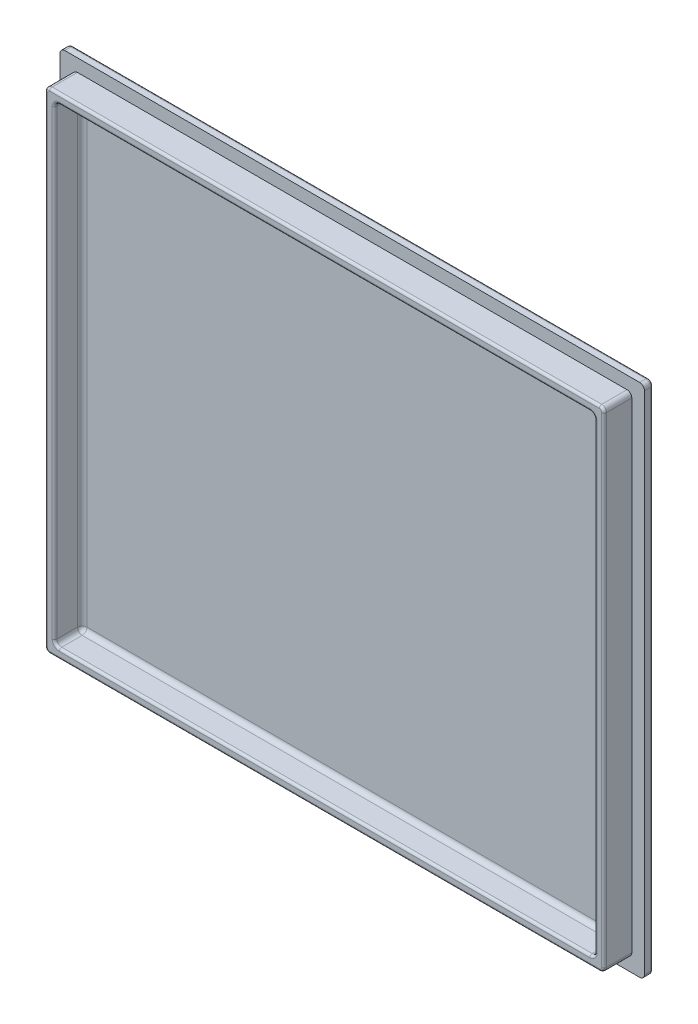
from build123d import *

# Parameters (mm, degrees)
SKETCH1_W           = 122.5
SKETCH1_H           = 108
BOSS_EXTRUDE1_DEPTH = 1.8
SKETCH2_W           = 117.2
SKETCH2_H           = 102.7
SKETCH2_W_2         = 113.2
SKETCH2_H_2         = 98.7
BOSS_EXTRUDE2_DEPTH = 5.8
FILLET1_R           = 1
FILLET2_R           = 0.5
CUT_EXTRUDE1_DEPTH  = 0.4


with BuildPart() as part:
    # Sketch1 → Boss-Extrude1 (new body)
    with BuildSketch(Plane.XY):
        Rectangle(SKETCH1_W, SKETCH1_H)
    extrude(amount=BOSS_EXTRUDE1_DEPTH)

    # Sketch2 → Boss-Extrude2 (add)
    with BuildSketch(Plane.XY.offset(1.8)):
        Rectangle(SKETCH2_W, SKETCH2_H)
        Rectangle(SKETCH2_W_2, SKETCH2_H_2, mode=Mode.SUBTRACT)
    extrude(amount=BOSS_EXTRUDE2_DEPTH)

    # Fillet1
    fillet1_edges = [part.edges().sort_by_distance(p)[0] for p in [
        (-56.6, 0, 1.8),
        (0, -49.35, 1.8),
        (56.6, 0, 1.8),
        (0, 49.35, 1.8),
        (-58.6, 51.35, 4.7),
        (-58.6, -51.35, 4.7),
        (58.6, -51.35, 4.7),
        (58.6, 51.35, 4.7),
        (-56.6, -49.35, 4.7),
        (56.6, -49.35, 4.7),
        (56.6, 49.35, 4.7),
        (-56.6, 49.35, 4.7),
        (61.25, -54, 0.9),
        (-61.25, -54, 0.9),
        (-61.25, 54, 0.9),
        (61.25, 54, 0.9),
    ]]
    fillet(fillet1_edges, radius=FILLET1_R)

    # Fillet2
    fillet2_edges = [part.edges().sort_by_distance(p)[0] for p in [
        (0, 49.35, 7.6),
        (56.6, 0, 7.6),
        (0, -49.35, 7.6),
        (-56.6, 0, 7.6),
        (0, -54, 0),
        (61.25, 0, 0),
        (-61.25, 0, 0),
        (0, 54, 0),
        (60.957106781, 53.707106781, 0),
        (60.957106781, -53.707106781, 0),
        (-60.957106781, 53.707106781, 0),
        (-60.957106781, -53.707106781, 0),
        (-58.6, 0, 7.6),
        (0, 51.35, 7.6),
        (0, -51.35, 7.6),
        (58.6, 0, 7.6),
        (58.307106781, 51.057106781, 7.6),
        (-58.307106781, -51.057106781, 7.6),
        (58.307106781, -51.057106781, 7.6),
        (-58.307106781, 51.057106781, 7.6),
        (56.307106781, -49.057106781, 7.6),
        (56.307106781, 49.057106781, 7.6),
        (-56.307106781, 49.057106781, 7.6),
        (-56.307106781, -49.057106781, 7.6),
    ]]
    fillet(fillet2_edges, radius=FILLET2_R)

    # Sketch3 → Cut-Extrude1 (cut)
    # profile 1 of 22: a face of its own
    with BuildSketch(Plane(origin=(0, 0, 0), x_dir=(-1, 0, 0), z_dir=(0, 0, -1))):
        with BuildLine():
            Line((-30.046875, 15.515625), (-30.046875, 11.715820313))
            add(Edge.make_bspline(
                [(-30.046875, 11.715820313), (-30.047557345, 11.636716191), (-30.048871794, 11.484332417), (-30.05548083, 11.264953882), (-30.069246102, 11.063773405), (-30.085589204, 10.877782305), (-30.112940714, 10.700218671), (-30.15008362, 10.524535589), (-30.203755596, 10.348311449), (-30.247407391, 10.232192122), (-30.26953125, 10.173339844)],
                knots=[0, 0, 0, 0, 1.210006368, 2.330919474, 3.356323987, 4.294191784, 5.185681834, 6.102709867, 7.038404292, 8, 8, 8, 8], degree=3))
            add(Edge.make_bspline(
                [(-30.26953125, 10.173339844), (-30.290338092, 10.12468765), (-30.331593248, 10.028221597), (-30.404876243, 9.890152603), (-30.489008033, 9.760522873), (-30.58269712, 9.639129424), (-30.685611034, 9.525508325), (-30.798838922, 9.421041247), (-30.92272024, 9.326318283), (-31.053992641, 9.237687704), (-31.195720277, 9.160534085), (-31.344841796, 9.090804071), (-31.503614251, 9.034506684), (-31.669918781, 8.987206239), (-31.844716369, 8.950938755), (-32.028101886, 8.92422726), (-32.220000118, 8.910313129), (-32.350566934, 8.907620077), (-32.416992187, 8.90625)],
                knots=[0, 0, 0, 0, 0.953881119, 1.891325734, 2.814479008, 3.737296314, 4.653537642, 5.575724681, 6.510892384, 7.463268797, 8.428782058, 9.417619489, 10.428630225, 11.462688628, 12.533322677, 13.645265432, 14.802039852, 16, 16, 16, 16], degree=3))
            add(Edge.make_bspline(
                [(-32.416992187, 8.90625), (-32.534785854, 8.909094695), (-32.760883214, 8.914554905), (-33.085542348, 8.95497497), (-33.379677086, 9.02433692), (-33.645019511, 9.122444802), (-33.883084533, 9.25358607), (-34.095856644, 9.419289536), (-34.284684073, 9.620731232), (-34.386512586, 9.776154768), (-34.438476562, 9.85546875)],
                knots=[0, 0, 0, 0, 1.20378012, 2.310578459, 3.337050898, 4.286231469, 5.193170284, 6.103603796, 7.032252521, 8, 8, 8, 8], degree=3))
            add(Edge.make_bspline(
                [(-34.438476562, 9.85546875), (-34.463920551, 9.903534711), (-34.515856845, 10.001646994), (-34.584907219, 10.15687609), (-34.64388007, 10.323449667), (-34.698757529, 10.496787548), (-34.739726129, 10.67431652), (-34.770992208, 10.849767363), (-34.791248266, 11.021007189), (-34.793383023, 11.134224253), (-34.794433594, 11.189941406)],
                knots=[0, 0, 0, 0, 0.935734867, 1.910022864, 2.920068211, 3.975205631, 5.037046427, 6.052390226, 7.041529002, 8, 8, 8, 8], degree=3))
            add(Edge.make_bspline(
                [(-34.794433594, 11.189941406), (-34.792578556, 11.244857696), (-34.789052635, 11.349238606), (-34.752122514, 11.495340285), (-34.690985175, 11.620870466), (-34.606374301, 11.725409805), (-34.500743751, 11.805478696), (-34.38202531, 11.865897996), (-34.248394555, 11.899646744), (-34.15545527, 11.904000083), (-34.107421875, 11.90625)],
                knots=[0, 0, 0, 0, 1.173039851, 2.229629267, 3.196748628, 4.139814058, 5.078064495, 6.012468433, 6.97279296, 8, 8, 8, 8], degree=3))
            add(Edge.make_bspline(
                [(-34.107421875, 11.90625), (-34.061803691, 11.904596289), (-33.974658017, 11.90143716), (-33.853138646, 11.869257072), (-33.748850533, 11.815200792), (-33.663143342, 11.737147007), (-33.592022485, 11.63718651), (-33.532740604, 11.514308798), (-33.479973667, 11.369060569), (-33.454449109, 11.262529301), (-33.440917969, 11.206054688)],
                knots=[0, 0, 0, 0, 1.023367024, 1.954966223, 2.799238581, 3.63850462, 4.533990685, 5.539973533, 6.695884835, 8, 8, 8, 8], degree=3))
            add(Edge.make_bspline(
                [(-33.440917969, 11.206054688), (-33.42718378, 11.144914824), (-33.401170396, 11.029112225), (-33.35762025, 10.865893274), (-33.318042144, 10.721076868), (-33.275393042, 10.593159598), (-33.225436737, 10.478674619), (-33.161392429, 10.374670133), (-33.083121465, 10.279116537), (-32.99092666, 10.191407055), (-32.879536275, 10.117675153), (-32.746132689, 10.067099929), (-32.593207248, 10.036235685), (-32.484536325, 10.032971072), (-32.427246094, 10.03125)],
                knots=[0, 0, 0, 0, 1.306183455, 2.473990433, 3.521252936, 4.435448757, 5.282948158, 6.119186039, 6.972897879, 7.851491932, 8.763418147, 9.736895206, 10.806913645, 12, 12, 12, 12], degree=3))
            add(Edge.make_bspline(
                [(-32.427246094, 10.03125), (-32.387659933, 10.032486396), (-32.311072875, 10.034878443), (-32.199531519, 10.050162936), (-32.097086909, 10.080879121), (-31.999980134, 10.11784165), (-31.912251174, 10.169828268), (-31.831846007, 10.232622181), (-31.758039178, 10.305673821), (-31.694090089, 10.391895351), (-31.635889144, 10.487495745), (-31.588594918, 10.595995186), (-31.54544516, 10.714023437), (-31.512912526, 10.844393413), (-31.484312932, 10.984948151), (-31.465874477, 11.137268742), (-31.456223585, 11.300653907), (-31.454180977, 11.413073354), (-31.453125, 11.471191406)],
                knots=[0, 0, 0, 0, 0.963361052, 1.863807676, 2.728602533, 3.560208343, 4.385341088, 5.19798089, 6.037943909, 6.902738766, 7.80318539, 8.754830499, 9.776827693, 10.857282673, 12.019774497, 13.264791246, 14.58596523, 16, 16, 16, 16], degree=3))
            Line((-31.453125, 11.471191406), (-31.453125, 15.509765625))
            add(Edge.make_bspline(
                [(-31.453125, 15.509765625), (-31.451198678, 15.579771909), (-31.447560429, 15.711992941), (-31.412453824, 15.896207675), (-31.356822294, 16.054710678), (-31.273227148, 16.183627886), (-31.168830369, 16.283627792), (-31.047011623, 16.356608249), (-30.906873086, 16.397876859), (-30.808371867, 16.403391876), (-30.757324219, 16.40625)],
                knots=[0, 0, 0, 0, 1.305302689, 2.465328236, 3.486148504, 4.421450945, 5.30454368, 6.162639947, 7.047799498, 8, 8, 8, 8], degree=3))
            add(Edge.make_bspline(
                [(-30.757324219, 16.40625), (-30.705198234, 16.404281792), (-30.604870923, 16.400493565), (-30.463804311, 16.35541414), (-30.338264323, 16.286101068), (-30.233223174, 16.185172275), (-30.147389594, 16.05737771), (-30.089109154, 15.900439469), (-30.051844022, 15.717070978), (-30.04860254, 15.585660121), (-30.046875, 15.515625)],
                knots=[0, 0, 0, 0, 0.965391849, 1.858097617, 2.723685037, 3.609584463, 4.538324685, 5.561246394, 6.700271746, 8, 8, 8, 8], degree=3))
        make_face()
    # profile 2 of 22: a face of its own
    with BuildSketch(Plane(origin=(0, 0, 0), x_dir=(-1, 0, 0), z_dir=(0, 0, -1))):
        with BuildLine():
            add(Edge.make_bspline(
                [(-25.196777344, 16.40625), (-25.103953521, 16.404946936), (-24.921943649, 16.402391876), (-24.654042029, 16.379230949), (-24.395663714, 16.344853051), (-24.14698363, 16.295369892), (-23.908618689, 16.23080155), (-23.680523501, 16.151445937), (-23.462404142, 16.057565898), (-23.254005513, 15.951003325), (-23.057616886, 15.830374847), (-22.871987867, 15.698461366), (-22.699221039, 15.553327636), (-22.538913675, 15.396247639), (-22.392088564, 15.226792777), (-22.256611177, 15.045903933), (-22.133525117, 14.852563577), (-22.024156057, 14.64681279), (-21.925895348, 14.431725901), (-21.840598478, 14.206672522), (-21.76940633, 13.972606101), (-21.710189819, 13.729138911), (-21.665309693, 13.476627294), (-21.633696839, 13.214479864), (-21.611811164, 12.943730614), (-21.610194942, 12.759810325), (-21.609375, 12.666503906)],
                knots=[0, 0, 0, 0, 1.137132438, 2.22970057, 3.292424762, 4.329649132, 5.333981859, 6.315987487, 7.286185149, 8.241436353, 9.181332131, 10.107725602, 11.0292572, 11.943085262, 12.854854597, 13.773819033, 14.709898734, 15.660115542, 16.626635295, 17.605574315, 18.606712189, 19.622473761, 20.67399022, 21.747038223, 22.857027702, 24, 24, 24, 24], degree=3))
            add(Edge.make_bspline(
                [(-21.609375, 12.666503906), (-21.612236463, 12.529681291), (-21.617850987, 12.261219335), (-21.660438971, 11.868195898), (-21.732633965, 11.494071676), (-21.830958179, 11.138998428), (-21.960192421, 10.805434355), (-22.117419853, 10.493817511), (-22.304187292, 10.205652032), (-22.518482598, 9.94119842), (-22.759486365, 9.7019547), (-23.028845105, 9.493389262), (-23.324888454, 9.315378239), (-23.644986712, 9.165436009), (-23.991057114, 9.047298892), (-24.362398942, 8.967874715), (-24.756718598, 8.913817681), (-25.028127226, 8.908817378), (-25.167480469, 8.90625)],
                knots=[0, 0, 0, 0, 1.119700056, 2.196982321, 3.230778928, 4.235358115, 5.208318876, 6.153781848, 7.087131445, 8.013361148, 8.934611457, 9.860297843, 10.794468433, 11.756326826, 12.748403726, 13.780058436, 14.860183413, 16, 16, 16, 16], degree=3))
            add(Edge.make_bspline(
                [(-25.167480469, 8.90625), (-25.305829686, 8.90958087), (-25.576673384, 8.916101654), (-25.971499241, 8.968354297), (-26.34481766, 9.052410131), (-26.69449719, 9.172594274), (-27.018095269, 9.325643475), (-27.316968746, 9.503792079), (-27.585319121, 9.714243232), (-27.826593308, 9.950989751), (-28.04077208, 10.214405028), (-28.222857641, 10.505794659), (-28.38344225, 10.818816651), (-28.510373607, 11.158114006), (-28.611361061, 11.516325766), (-28.68253515, 11.890781818), (-28.725931166, 12.279247212), (-28.73153067, 12.542855196), (-28.734375, 12.676757813)],
                knots=[0, 0, 0, 0, 1.130091603, 2.212359386, 3.247930852, 4.252250901, 5.226719473, 6.16821431, 7.089197795, 8.00610207, 8.925165125, 9.855999165, 10.808795857, 11.79501972, 12.810514548, 13.846493258, 14.906102224, 16, 16, 16, 16], degree=3))
            add(Edge.make_bspline(
                [(-28.734375, 12.676757813), (-28.731794897, 12.813123311), (-28.726721491, 13.081266672), (-28.679880961, 13.474123592), (-28.605926211, 13.850241465), (-28.500515847, 14.207726794), (-28.36686457, 14.544068229), (-28.20464001, 14.855597765), (-28.016818058, 15.141349776), (-27.80215582, 15.400780424), (-27.560312411, 15.632310235), (-27.292640828, 15.834794061), (-27.000458652, 16.008973051), (-26.683752456, 16.152238026), (-26.343963136, 16.267227072), (-25.981179063, 16.348412804), (-25.596082294, 16.397596314), (-25.332181227, 16.403315544), (-25.196777344, 16.40625)],
                knots=[0, 0, 0, 0, 1.125218611, 2.212582392, 3.260701818, 4.286054269, 5.284468473, 6.243521648, 7.180287843, 8.101949555, 9.017004541, 9.937572836, 10.866572707, 11.818894766, 12.801573564, 13.82236102, 14.882684417, 16, 16, 16, 16], degree=3))
        make_face()
        with BuildLine():
            add(Edge.make_bspline(
                [(-23.109375, 12.676757813), (-23.112239567, 12.807290522), (-23.117786032, 13.060032098), (-23.166943085, 13.425641394), (-23.246562329, 13.764762036), (-23.341458535, 14.027343783), (-23.432582367, 14.221981754), (-23.507003023, 14.357450361), (-23.587057743, 14.484987604), (-23.677918083, 14.600344408), (-23.772168099, 14.709023688), (-23.874210567, 14.808462676), (-23.984223246, 14.897180755), (-24.13838782, 15.00486256), (-24.34599589, 15.11643983), (-24.614050789, 15.21204985), (-24.899787334, 15.270968536), (-25.096394289, 15.27777485), (-25.196777344, 15.28125)],
                knots=[0, 0, 0, 0, 1.663767962, 3.22144036, 4.693807908, 6.09809827, 6.772124886, 7.43249818, 8.068074837, 8.689496673, 9.30272399, 9.901527182, 10.503429657, 11.102750509, 12.297797107, 13.495176895, 14.721094103, 16, 16, 16, 16], degree=3))
            add(Edge.make_bspline(
                [(-25.196777344, 15.28125), (-25.268683164, 15.279461327), (-25.410798157, 15.275926186), (-25.61941784, 15.242353303), (-25.819816768, 15.189848909), (-26.011062575, 15.116413025), (-26.19145206, 15.022631636), (-26.360178234, 14.908774737), (-26.515206508, 14.775285571), (-26.657404638, 14.622704684), (-26.785922851, 14.449494607), (-26.899942435, 14.253858622), (-26.99928744, 14.035794097), (-27.083982869, 13.797246773), (-27.150968666, 13.539443302), (-27.198598961, 13.265086624), (-27.228520242, 12.97575706), (-27.232394389, 12.77790652), (-27.234375, 12.676757813)],
                knots=[0, 0, 0, 0, 0.926902171, 1.831933723, 2.71800685, 3.595261319, 4.468550136, 5.334998465, 6.214894287, 7.1017058, 8.020008637, 8.99111482, 10.01694856, 11.106630737, 12.25237115, 13.448355624, 14.695502513, 16, 16, 16, 16], degree=3))
            add(Edge.make_bspline(
                [(-27.234375, 12.676757813), (-27.232388921, 12.574634374), (-27.22850333, 12.374838703), (-27.198643118, 12.082573109), (-27.150701899, 11.804885811), (-27.084194453, 11.542926095), (-26.998152674, 11.299747953), (-26.89486427, 11.077579628), (-26.779073356, 10.874836419), (-26.642473979, 10.697171482), (-26.494923833, 10.540390834), (-26.336350989, 10.403835916), (-26.167899684, 10.287505513), (-25.987956828, 10.192801372), (-25.7975089, 10.121743717), (-25.598661191, 10.067891189), (-25.390122793, 10.037132148), (-25.248143622, 10.033226935), (-25.176269531, 10.03125)],
                knots=[0, 0, 0, 0, 1.300369924, 2.54406124, 3.737115199, 4.88637188, 5.981883645, 7.016846829, 8.003376514, 8.948590554, 9.863559023, 10.741055788, 11.608647785, 12.46534091, 13.323432129, 14.192248925, 15.0848625, 16, 16, 16, 16], degree=3))
            add(Edge.make_bspline(
                [(-25.176269531, 10.03125), (-25.083697318, 10.034350516), (-24.901298636, 10.040459585), (-24.634218732, 10.097499603), (-24.379042185, 10.187181804), (-24.176997685, 10.290442989), (-24.024721749, 10.392161634), (-23.914681757, 10.477977168), (-23.812383256, 10.575631145), (-23.714874132, 10.681353913), (-23.624519148, 10.797450754), (-23.538971461, 10.922449348), (-23.459987404, 11.057686013), (-23.386913423, 11.20240464), (-23.32092258, 11.35634196), (-23.263363298, 11.519089161), (-23.217478217, 11.691361703), (-23.177430966, 11.87155969), (-23.146965096, 12.060868402), (-23.125300865, 12.25838107), (-23.111726827, 12.464653338), (-23.11017111, 12.604958952), (-23.109375, 12.676757813)],
                knots=[0, 0, 0, 0, 1.468568495, 2.893578421, 4.316075305, 5.755382189, 6.482330971, 7.222315454, 7.968369796, 8.725783183, 9.504530818, 10.302500265, 11.129737207, 11.9897977, 12.875655565, 13.787998707, 14.728608307, 15.705132475, 16.718642732, 17.771954593, 18.859838044, 20, 20, 20, 20], degree=3))
        make_face(mode=Mode.SUBTRACT)
    # profile 3 of 22: a face of its own
    with BuildSketch(Plane(origin=(0, 0, 0), x_dir=(-1, 0, 0), z_dir=(0, 0, -1))):
        with BuildLine():
            Line((-20.296875, 12.027832031), (-20.296875, 15.515625))
            add(Edge.make_bspline(
                [(-20.296875, 15.515625), (-20.295146872, 15.585659194), (-20.291904287, 15.717068313), (-20.254646403, 15.900448225), (-20.196342562, 16.057349593), (-20.110585709, 16.185265064), (-20.005897158, 16.285184075), (-19.883477802, 16.355161602), (-19.74723779, 16.400231352), (-19.650757558, 16.404204165), (-19.601074219, 16.40625)],
                knots=[0, 0, 0, 0, 1.314006093, 2.465543923, 3.499702682, 4.438645347, 5.334276599, 6.193453487, 7.069703068, 8, 8, 8, 8], degree=3))
            add(Edge.make_bspline(
                [(-19.601074219, 16.40625), (-19.549034135, 16.403455419), (-19.449054319, 16.398086448), (-19.306801493, 16.356239043), (-19.182532819, 16.284192332), (-19.076378706, 16.183727671), (-18.991638804, 16.054577579), (-18.932287764, 15.896710235), (-18.895926176, 15.712094468), (-18.892459288, 15.579774509), (-18.890625, 15.509765625)],
                knots=[0, 0, 0, 0, 0.96282878, 1.849794185, 2.716851436, 3.599658085, 4.532680285, 5.552030856, 6.704809248, 8, 8, 8, 8], degree=3))
            Line((-18.890625, 15.509765625), (-18.890625, 11.919433594))
            add(Edge.make_bspline(
                [(-18.890625, 11.919433594), (-18.88896099, 11.821235593), (-18.885776139, 11.633288482), (-18.861153533, 11.363416244), (-18.819555534, 11.1187183), (-18.760828211, 10.897681447), (-18.678607307, 10.700229845), (-18.569297614, 10.526335706), (-18.432260767, 10.376345914), (-18.297208954, 10.271477757), (-18.175605283, 10.202089325), (-18.074446639, 10.156508461), (-17.96508357, 10.116486396), (-17.845931107, 10.087122695), (-17.719499161, 10.061336401), (-17.583817451, 10.044800712), (-17.439696126, 10.031996788), (-17.340363977, 10.031502733), (-17.289550781, 10.03125)],
                knots=[0, 0, 0, 0, 1.640841622, 3.140506311, 4.523579023, 5.784571649, 6.954579444, 8.084197464, 9.198982671, 10.333306227, 10.925380769, 11.535182691, 12.185613052, 12.868404783, 13.583722754, 14.340779317, 15.151228418, 16, 16, 16, 16], degree=3))
            add(Edge.make_bspline(
                [(-17.289550781, 10.03125), (-17.219652438, 10.032488531), (-17.084856951, 10.034876977), (-16.890998029, 10.057752844), (-16.712341472, 10.09118436), (-16.55058932, 10.143143292), (-16.403631665, 10.207455987), (-16.27278386, 10.286362126), (-16.157477736, 10.380206623), (-16.058606607, 10.489666249), (-15.975165921, 10.615094367), (-15.901342478, 10.753195607), (-15.840494884, 10.90684669), (-15.789005599, 11.074238926), (-15.749767614, 11.257064412), (-15.72257464, 11.454387413), (-15.706561042, 11.666727531), (-15.704297139, 11.812959872), (-15.703125, 11.888671875)],
                knots=[0, 0, 0, 0, 1.187087794, 2.289239917, 3.312641325, 4.270309596, 5.169103343, 6.032749862, 6.858132282, 7.686303516, 8.528484611, 9.411791075, 10.342302716, 11.33164497, 12.384483705, 13.515514569, 14.713654137, 16, 16, 16, 16], degree=3))
            Line((-15.703125, 11.888671875), (-15.703125, 15.509765625))
            add(Edge.make_bspline(
                [(-15.703125, 15.509765625), (-15.701152924, 15.58071911), (-15.697452358, 15.713862034), (-15.663337742, 15.899799065), (-15.603711168, 16.056902331), (-15.519877824, 16.185081109), (-15.416203048, 16.286081405), (-15.292874569, 16.354713587), (-15.155530557, 16.400621444), (-15.058014651, 16.404324887), (-15.007324219, 16.40625)],
                knots=[0, 0, 0, 0, 1.324209478, 2.484855026, 3.512713035, 4.440887327, 5.324452051, 6.186293477, 7.057204391, 8, 8, 8, 8], degree=3))
            add(Edge.make_bspline(
                [(-15.007324219, 16.40625), (-14.956671237, 16.404202394), (-14.858292888, 16.400225529), (-14.719194495, 16.355185457), (-14.594438226, 16.285696562), (-14.487288029, 16.186407102), (-14.398792471, 16.059395029), (-14.338347826, 15.901296805), (-14.302150757, 15.716002986), (-14.298704393, 15.583193193), (-14.296875, 15.512695313)],
                knots=[0, 0, 0, 0, 0.937671153, 1.821147261, 2.686184232, 3.571984669, 4.510357278, 5.535961965, 6.692043289, 8, 8, 8, 8], degree=3))
            Line((-14.296875, 15.512695313), (-14.296875, 12.01171875))
            add(Edge.make_bspline(
                [(-14.296875, 12.01171875), (-14.298847418, 11.875440511), (-14.302634598, 11.613776875), (-14.331025919, 11.238859506), (-14.380669028, 10.899209785), (-14.447767244, 10.590603142), (-14.545113897, 10.307585952), (-14.678978125, 10.045710465), (-14.8472184, 9.800451933), (-14.984745128, 9.655972949), (-15.054199219, 9.583007812)],
                knots=[0, 0, 0, 0, 1.248457049, 2.397123805, 3.441600438, 4.391152342, 5.286682789, 6.174943873, 7.078305605, 8, 8, 8, 8], degree=3))
            add(Edge.make_bspline(
                [(-15.054199219, 9.583007812), (-15.120850225, 9.526699466), (-15.253996226, 9.414214574), (-15.4758685, 9.2744411), (-15.711986229, 9.155694832), (-15.965597237, 9.06195424), (-16.238167591, 8.991788363), (-16.53129762, 8.943057854), (-16.845996679, 8.911603727), (-17.063397501, 8.908069206), (-17.175292969, 8.90625)],
                knots=[0, 0, 0, 0, 0.917673777, 1.83319953, 2.752815171, 3.696261941, 4.673826777, 5.7116717, 6.822205161, 8, 8, 8, 8], degree=3))
            add(Edge.make_bspline(
                [(-17.175292969, 8.90625), (-17.308186532, 8.908418141), (-17.564660384, 8.91260248), (-17.93511442, 8.946819482), (-18.27736461, 9.000763176), (-18.59120097, 9.079938307), (-18.878262837, 9.181043198), (-19.135648971, 9.311731691), (-19.369128309, 9.462019208), (-19.572900799, 9.641592073), (-19.750514215, 9.846119646), (-19.903066164, 10.076717487), (-20.026178722, 10.335476681), (-20.128810633, 10.619242222), (-20.202434746, 10.93170181), (-20.258734422, 11.271218718), (-20.289861091, 11.640049288), (-20.294480639, 11.895453394), (-20.296875, 12.027832031)],
                knots=[0, 0, 0, 0, 1.244583114, 2.401944964, 3.48169555, 4.486712429, 5.430003149, 6.325898902, 7.184706889, 8.024138875, 8.860562605, 9.715550095, 10.605366032, 11.538500779, 12.536866304, 13.60758979, 14.759988597, 16, 16, 16, 16], degree=3))
        make_face()
    # profile 4 of 22: a face of its own
    with BuildSketch(Plane(origin=(0, 0, 0), x_dir=(-1, 0, 0), z_dir=(0, 0, -1))):
        with BuildLine():
            Line((-11.296875, 15.512695313), (-11.296875, 10.21875))
            Line((-11.296875, 10.21875), (-8.3203125, 10.21875))
            add(Edge.make_bspline(
                [(-8.3203125, 10.21875), (-8.264431535, 10.2172871), (-8.157869972, 10.21449744), (-8.008886269, 10.180012338), (-7.878365392, 10.126654826), (-7.772834862, 10.047307781), (-7.687774219, 9.954500459), (-7.6259966, 9.848349045), (-7.589861841, 9.729833876), (-7.585649643, 9.647218716), (-7.583496094, 9.604980469)],
                knots=[0, 0, 0, 0, 1.240270116, 2.365118784, 3.381765818, 4.352609133, 5.275186246, 6.165500839, 7.062084633, 8, 8, 8, 8], degree=3))
            add(Edge.make_bspline(
                [(-7.583496094, 9.604980469), (-7.585561979, 9.561752756), (-7.589558199, 9.478133635), (-7.626039798, 9.358706914), (-7.687084611, 9.253351492), (-7.771067036, 9.162506629), (-7.87646589, 9.087417874), (-8.006390887, 9.037559482), (-8.156046934, 9.004345058), (-8.263463127, 9.001503747), (-8.3203125, 9)],
                knots=[0, 0, 0, 0, 0.961785517, 1.860465312, 2.752861249, 3.654173772, 4.599371787, 5.609990076, 6.735101654, 8, 8, 8, 8], degree=3))
            Line((-8.3203125, 9), (-11.841796875, 9))
            add(Edge.make_bspline(
                [(-11.841796875, 9), (-11.913358444, 9.001872359), (-12.046633409, 9.005359406), (-12.230453231, 9.047257735), (-12.384993007, 9.111499373), (-12.508127522, 9.209140298), (-12.598882716, 9.339200098), (-12.660985106, 9.499737551), (-12.69609223, 9.691860425), (-12.700673411, 9.829924512), (-12.703125, 9.903808594)],
                knots=[0, 0, 0, 0, 1.184943227, 2.206816713, 3.109923682, 3.939837529, 4.776053014, 5.71019795, 6.774627611, 8, 8, 8, 8], degree=3))
            Line((-12.703125, 9.903808594), (-12.703125, 15.512695313))
            add(Edge.make_bspline(
                [(-12.703125, 15.512695313), (-12.701313102, 15.582702669), (-12.697900936, 15.714540511), (-12.661556645, 15.898264986), (-12.601718154, 16.054882387), (-12.517464455, 16.183837463), (-12.411607777, 16.283266003), (-12.290494557, 16.355976546), (-12.153046921, 16.397838828), (-12.056921996, 16.403387197), (-12.007324219, 16.40625)],
                knots=[0, 0, 0, 0, 1.312227502, 2.471186598, 3.495416453, 4.440711492, 5.33513045, 6.197779038, 7.0701043, 8, 8, 8, 8], degree=3))
            add(Edge.make_bspline(
                [(-12.007324219, 16.40625), (-11.956671214, 16.404202398), (-11.858292822, 16.400225541), (-11.71919474, 16.355185411), (-11.594437315, 16.285696733), (-11.487291612, 16.18640643), (-11.39877766, 16.059397807), (-11.338584055, 15.901735353), (-11.301906674, 15.716533127), (-11.298627552, 15.583692843), (-11.296875, 15.512695313)],
                knots=[0, 0, 0, 0, 0.937651975, 1.821110013, 2.686129292, 3.571911612, 4.510265029, 5.535848738, 6.683015045, 8, 8, 8, 8], degree=3))
        make_face()
    # profile 5 of 22: a face of its own
    with BuildSketch(Plane(origin=(0, 0, 0), x_dir=(-1, 0, 0), z_dir=(0, 0, -1))):
        with BuildLine():
            Line((-1.801757813, 15.09375), (-5.109375, 15.09375))
            Line((-5.109375, 15.09375), (-5.109375, 13.3125))
            Line((-5.109375, 13.3125), (-2.063964844, 13.3125))
            add(Edge.make_bspline(
                [(-2.063964844, 13.3125), (-2.011117234, 13.310499943), (-1.911919206, 13.306745721), (-1.773060758, 13.28019061), (-1.655625248, 13.231450001), (-1.560086538, 13.163434108), (-1.486712377, 13.07883871), (-1.432775125, 12.982400204), (-1.401242348, 12.872030031), (-1.397790918, 12.794639441), (-1.395996094, 12.754394531)],
                knots=[0, 0, 0, 0, 1.285293232, 2.412569968, 3.418386025, 4.354403319, 5.23810445, 6.120527863, 7.022630715, 8, 8, 8, 8], degree=3))
            add(Edge.make_bspline(
                [(-1.395996094, 12.754394531), (-1.397740492, 12.714124963), (-1.401094955, 12.636686953), (-1.433363054, 12.526458578), (-1.485309265, 12.427993789), (-1.557981242, 12.341619138), (-1.652728898, 12.271095052), (-1.770462135, 12.221139358), (-1.91029866, 12.192864126), (-2.010606243, 12.189362623), (-2.063964844, 12.1875)],
                knots=[0, 0, 0, 0, 0.971200242, 1.867609123, 2.749214551, 3.645234956, 4.57279535, 5.576919765, 6.711042891, 8, 8, 8, 8], degree=3))
            Line((-2.063964844, 12.1875), (-5.109375, 12.1875))
            Line((-5.109375, 12.1875), (-5.109375, 10.125))
            Line((-5.109375, 10.125), (-1.6875, 10.125))
            add(Edge.make_bspline(
                [(-1.6875, 10.125), (-1.63319901, 10.122968169), (-1.531118955, 10.119148545), (-1.387236267, 10.092772064), (-1.265305119, 10.042668469), (-1.164619379, 9.974077008), (-1.085050695, 9.889889618), (-1.030320035, 9.789782074), (-0.994768837, 9.678161067), (-0.991775762, 9.598915633), (-0.990234375, 9.558105469)],
                knots=[0, 0, 0, 0, 1.281412047, 2.408917619, 3.431661904, 4.368016538, 5.264760761, 6.136510243, 7.040331808, 8, 8, 8, 8], degree=3))
            add(Edge.make_bspline(
                [(-0.990234375, 9.558105469), (-0.991695332, 9.518240316), (-0.994514505, 9.441313508), (-1.030961541, 9.332899099), (-1.085446328, 9.234851522), (-1.164635373, 9.151028698), (-1.264965997, 9.081915175), (-1.38780435, 9.034572721), (-1.530847587, 9.005149913), (-1.633138565, 9.00178712), (-1.6875, 9)],
                knots=[0, 0, 0, 0, 0.944744106, 1.823049547, 2.692159438, 3.596595969, 4.540982691, 5.5681055, 6.707595947, 8, 8, 8, 8], degree=3))
            Line((-1.6875, 9), (-5.654296875, 9))
            add(Edge.make_bspline(
                [(-5.654296875, 9), (-5.725804653, 9.002080975), (-5.858872775, 9.00595344), (-6.043237929, 9.045290679), (-6.196909912, 9.110355932), (-6.321118482, 9.206076585), (-6.410913531, 9.336057185), (-6.473605385, 9.495218651), (-6.508568697, 9.686014754), (-6.513164554, 9.823096217), (-6.515625, 9.896484375)],
                knots=[0, 0, 0, 0, 1.189456171, 2.21344733, 3.119993849, 3.948013107, 4.78741338, 5.71757596, 6.778077714, 8, 8, 8, 8], degree=3))
            Line((-6.515625, 9.896484375), (-6.515625, 15.322265625))
            add(Edge.make_bspline(
                [(-6.515625, 15.322265625), (-6.514498817, 15.372605022), (-6.512360321, 15.46819391), (-6.496454894, 15.604644771), (-6.469392192, 15.726808639), (-6.429578673, 15.835249068), (-6.378749492, 15.93069899), (-6.312831114, 16.011481764), (-6.234050694, 16.077882297), (-6.143064409, 16.131754914), (-6.038548521, 16.170273646), (-5.92238, 16.200242008), (-5.792375128, 16.215198207), (-5.701689441, 16.217530919), (-5.654296875, 16.21875)],
                knots=[0, 0, 0, 0, 1.257097402, 2.387087425, 3.425508426, 4.374733264, 5.264346199, 6.113849079, 6.961774747, 7.825601221, 8.740599092, 9.73444991, 10.816017894, 12, 12, 12, 12], degree=3))
            Line((-5.654296875, 16.21875), (-1.801757813, 16.21875))
            add(Edge.make_bspline(
                [(-1.801757813, 16.21875), (-1.746987064, 16.216675053), (-1.643973643, 16.212772469), (-1.499335979, 16.187060865), (-1.378191279, 16.136257484), (-1.278484892, 16.068399777), (-1.20349846, 15.982992088), (-1.146534527, 15.886703102), (-1.114158188, 15.776432588), (-1.110673924, 15.698932363), (-1.108886719, 15.659179688)],
                knots=[0, 0, 0, 0, 1.304353081, 2.453241492, 3.474309848, 4.409392115, 5.298405909, 6.157667996, 7.055001114, 8, 8, 8, 8], degree=3))
            add(Edge.make_bspline(
                [(-1.108886719, 15.659179688), (-1.110604123, 15.618429598), (-1.113933066, 15.539441392), (-1.146973229, 15.427123703), (-1.202528613, 15.328430167), (-1.278639472, 15.242803261), (-1.377827533, 15.174443463), (-1.499743128, 15.125921841), (-1.643906037, 15.099570674), (-1.746963596, 15.095770499), (-1.801757813, 15.09375)],
                knots=[0, 0, 0, 0, 0.962139494, 1.864969442, 2.738963821, 3.622448103, 4.551714319, 5.562017248, 6.70375977, 8, 8, 8, 8], degree=3))
        make_face()
    # profile 6 of 22: a face of its own
    with BuildSketch(Plane(origin=(0, 0, 0), x_dir=(-1, 0, 0), z_dir=(0, 0, -1))):
        with BuildLine():
            Line((2.620605469, 10.117675781), (1.453125, 14.71875))
            Line((1.453125, 14.71875), (1.453125, 9.733886719))
            add(Edge.make_bspline(
                [(1.453125, 9.733886719), (1.451163245, 9.668749835), (1.447489199, 9.54675912), (1.413188001, 9.376307142), (1.359724399, 9.229820408), (1.278169338, 9.111056582), (1.179056204, 9.019120919), (1.064297993, 8.952094058), (0.933569679, 8.913493944), (0.84156456, 8.908720566), (0.793945312, 8.90625)],
                knots=[0, 0, 0, 0, 1.30362474, 2.441475632, 3.469867302, 4.406120522, 5.299256138, 6.158467928, 7.046875082, 8, 8, 8, 8], degree=3))
            add(Edge.make_bspline(
                [(0.793945312, 8.90625), (0.747757565, 8.908691748), (0.658092932, 8.913431931), (0.53054656, 8.953024995), (0.416284895, 9.01744071), (0.3164592, 9.108150803), (0.236686715, 9.22661659), (0.179180559, 9.371198343), (0.14672024, 9.542034987), (0.14274126, 9.664407277), (0.140625, 9.729492188)],
                knots=[0, 0, 0, 0, 0.931401934, 1.808137819, 2.66942439, 3.563139973, 4.50699297, 5.529036112, 6.685793447, 8, 8, 8, 8], degree=3))
            Line((0.140625, 9.729492188), (0.140625, 15.418945313))
            add(Edge.make_bspline(
                [(0.140625, 15.418945313), (0.141693797, 15.456558044), (0.143752136, 15.528994375), (0.153062178, 15.633065928), (0.172013883, 15.727933602), (0.199571614, 15.812328663), (0.234034786, 15.887490257), (0.274334833, 15.954215578), (0.324765517, 16.010520765), (0.403666005, 16.072024018), (0.518850908, 16.131811318), (0.675139918, 16.183106114), (0.852346815, 16.213569174), (0.977415483, 16.216968358), (1.04296875, 16.21875)],
                knots=[0, 0, 0, 0, 0.969665939, 1.867427353, 2.689218696, 3.457225703, 4.149776576, 4.816702983, 5.458338976, 6.085245707, 7.385799533, 8.77853966, 10.311509556, 12, 12, 12, 12], degree=3))
            Line((1.04296875, 16.21875), (1.492675781, 16.21875))
            add(Edge.make_bspline(
                [(1.492675781, 16.21875), (1.555677503, 16.217971496), (1.672566568, 16.216527112), (1.83389565, 16.204737268), (1.96732963, 16.181599944), (2.076809289, 16.150567842), (2.166381792, 16.104119941), (2.242333431, 16.045333315), (2.304916433, 15.969966516), (2.3557128, 15.877376607), (2.401037923, 15.763023607), (2.448342329, 15.622257402), (2.501671384, 15.45270676), (2.534255783, 15.328774602), (2.551757812, 15.262207031)],
                knots=[0, 0, 0, 0, 1.38803647, 2.575267475, 3.558583177, 4.368440808, 5.070869684, 5.768090105, 6.470518981, 7.212366556, 8.085347214, 9.177334938, 10.483864409, 12, 12, 12, 12], degree=3))
            Line((2.551757812, 15.262207031), (3.609375, 11.34375))
            Line((3.609375, 11.34375), (4.653808594, 15.262207031))
            add(Edge.make_bspline(
                [(4.653808594, 15.262207031), (4.671317323, 15.328770732), (4.703914195, 15.452695686), (4.75716393, 15.622292141), (4.804698511, 15.762925406), (4.849475473, 15.877873383), (4.902339556, 15.969556591), (4.964597525, 16.045395996), (5.040682503, 16.104082726), (5.130604019, 16.150877797), (5.241225087, 16.181498062), (5.376063462, 16.204749313), (5.538377211, 16.216479717), (5.655749899, 16.217957042), (5.71875, 16.21875)],
                knots=[0, 0, 0, 0, 1.511478991, 2.813995637, 3.902629473, 4.772928891, 5.517843496, 6.218114959, 6.913193965, 7.613465427, 8.431097637, 9.421953472, 10.616226692, 12, 12, 12, 12], degree=3))
            Line((5.71875, 16.21875), (6.169921875, 16.21875))
            add(Edge.make_bspline(
                [(6.169921875, 16.21875), (6.235956364, 16.216950866), (6.361981491, 16.213517264), (6.54025294, 16.183333312), (6.69689661, 16.131736577), (6.812346217, 16.072190372), (6.890990536, 16.010039501), (6.943209495, 15.954821325), (6.982720004, 15.886998806), (7.020108526, 15.813074532), (7.044181057, 15.727349105), (7.066445378, 15.633358422), (7.07478089, 15.528940032), (7.076982045, 15.45653947), (7.078125, 15.418945313)],
                knots=[0, 0, 0, 0, 1.69575107, 3.236297379, 4.624693315, 5.921190494, 6.546141798, 7.194208304, 7.859054455, 8.55478081, 9.316580419, 10.138397467, 11.033358612, 12, 12, 12, 12], degree=3))
            Line((7.078125, 15.418945313), (7.078125, 9.729492188))
            add(Edge.make_bspline(
                [(7.078125, 9.729492188), (7.076107366, 9.664858098), (7.072315375, 9.543383206), (7.03853212, 9.373712308), (6.984250429, 9.228107989), (6.903657988, 9.109583151), (6.803315588, 9.018746296), (6.687781664, 8.952068927), (6.555608252, 8.913503207), (6.462653721, 8.908723464), (6.414550781, 8.90625)],
                knots=[0, 0, 0, 0, 1.293518314, 2.431070022, 3.450077594, 4.386084638, 5.272371044, 6.139835868, 7.037385671, 8, 8, 8, 8], degree=3))
            add(Edge.make_bspline(
                [(6.414550781, 8.90625), (6.368866709, 8.908724674), (6.280189056, 8.913528281), (6.153576632, 8.952740898), (6.040971474, 9.019548319), (5.941913604, 9.110978892), (5.860821246, 9.230147755), (5.805085669, 9.37592739), (5.77141664, 9.546821252), (5.767641001, 9.668771463), (5.765625, 9.733886719)],
                knots=[0, 0, 0, 0, 0.922456205, 1.790585791, 2.649061979, 3.550299627, 4.495046019, 5.536376652, 6.684549498, 8, 8, 8, 8], degree=3))
            Line((5.765625, 9.733886719), (5.765625, 14.71875))
            Line((5.765625, 14.71875), (4.598144531, 10.117675781))
            add(Edge.make_bspline(
                [(4.598144531, 10.117675781), (4.580370765, 10.047775507), (4.547357379, 9.917941188), (4.497347939, 9.738885251), (4.452955389, 9.589626032), (4.415884391, 9.463760192), (4.370016012, 9.355500603), (4.311276125, 9.256212492), (4.234237503, 9.164124221), (4.147418805, 9.074142727), (4.040485957, 8.997614758), (3.913257449, 8.943411191), (3.767236728, 8.910972097), (3.663752659, 8.907876592), (3.609375, 8.90625)],
                knots=[0, 0, 0, 0, 1.501096557, 2.788170037, 3.868651286, 4.742863802, 5.516817816, 6.309819568, 7.133547599, 8.010237478, 8.906902995, 9.849006967, 10.869720086, 12, 12, 12, 12], degree=3))
            add(Edge.make_bspline(
                [(3.609375, 8.90625), (3.567776148, 8.907648329), (3.487461146, 8.910348087), (3.372227979, 8.931233613), (3.266244848, 8.964636329), (3.17086198, 9.013509138), (3.086090943, 9.073430603), (3.012224925, 9.14262275), (2.945330855, 9.216229389), (2.873214575, 9.328753833), (2.79971396, 9.483388771), (2.734581194, 9.685116273), (2.680839922, 9.899229464), (2.640915015, 10.044021164), (2.620605469, 10.117675781)],
                knots=[0, 0, 0, 0, 0.868933015, 1.67765103, 2.439282522, 3.183205666, 3.908055228, 4.601401517, 5.295498424, 5.980457608, 7.386244959, 8.861049734, 10.403235965, 12, 12, 12, 12], degree=3))
        make_face()
    # profile 7 of 22: a face of its own
    with BuildSketch(Plane(origin=(0, 0, 0), x_dir=(-1, 0, 0), z_dir=(0, 0, -1))):
        with BuildLine():
            Line((13.385742188, 15.09375), (10.078125, 15.09375))
            Line((10.078125, 15.09375), (10.078125, 13.3125))
            Line((10.078125, 13.3125), (13.123535156, 13.3125))
            add(Edge.make_bspline(
                [(13.123535156, 13.3125), (13.176382766, 13.310499943), (13.275580794, 13.306745721), (13.414439242, 13.28019061), (13.531874752, 13.231450001), (13.627413462, 13.163434108), (13.700787623, 13.07883871), (13.754724875, 12.982400204), (13.786257652, 12.872030031), (13.789709082, 12.794639441), (13.791503906, 12.754394531)],
                knots=[0, 0, 0, 0, 1.285293232, 2.412569968, 3.418386025, 4.354403319, 5.23810445, 6.120527863, 7.022630715, 8, 8, 8, 8], degree=3))
            add(Edge.make_bspline(
                [(13.791503906, 12.754394531), (13.789759508, 12.714124963), (13.786405045, 12.636686953), (13.754136946, 12.526458578), (13.702190735, 12.427993789), (13.629518758, 12.341619138), (13.534771102, 12.271095052), (13.417037865, 12.221139358), (13.27720134, 12.192864126), (13.176893757, 12.189362623), (13.123535156, 12.1875)],
                knots=[0, 0, 0, 0, 0.971200242, 1.867609123, 2.749214551, 3.645234956, 4.57279535, 5.576919765, 6.711042891, 8, 8, 8, 8], degree=3))
            Line((13.123535156, 12.1875), (10.078125, 12.1875))
            Line((10.078125, 12.1875), (10.078125, 10.125))
            Line((10.078125, 10.125), (13.5, 10.125))
            add(Edge.make_bspline(
                [(13.5, 10.125), (13.55430099, 10.122968169), (13.656381045, 10.119148545), (13.800263733, 10.092772064), (13.922194881, 10.042668469), (14.022880621, 9.974077008), (14.102449305, 9.889889618), (14.157179965, 9.789782074), (14.192731163, 9.678161067), (14.195724238, 9.598915633), (14.197265625, 9.558105469)],
                knots=[0, 0, 0, 0, 1.281412047, 2.408917619, 3.431661904, 4.368016538, 5.264760761, 6.136510243, 7.040331808, 8, 8, 8, 8], degree=3))
            add(Edge.make_bspline(
                [(14.197265625, 9.558105469), (14.195804668, 9.518240316), (14.192985495, 9.441313508), (14.156538459, 9.332899099), (14.102053672, 9.234851522), (14.022864627, 9.151028698), (13.922534003, 9.081915175), (13.79969565, 9.034572721), (13.656652413, 9.005149913), (13.554361435, 9.00178712), (13.5, 9)],
                knots=[0, 0, 0, 0, 0.944744106, 1.823049547, 2.692159438, 3.596595969, 4.540982691, 5.5681055, 6.707595947, 8, 8, 8, 8], degree=3))
            Line((13.5, 9), (9.533203125, 9))
            add(Edge.make_bspline(
                [(9.533203125, 9), (9.461695347, 9.002080975), (9.328627225, 9.00595344), (9.144262071, 9.045290679), (8.990590088, 9.110355932), (8.866381518, 9.206076585), (8.776586469, 9.336057185), (8.713894615, 9.495218651), (8.678931303, 9.686014754), (8.674335446, 9.823096217), (8.671875, 9.896484375)],
                knots=[0, 0, 0, 0, 1.189456171, 2.21344733, 3.119993849, 3.948013107, 4.78741338, 5.71757596, 6.778077714, 8, 8, 8, 8], degree=3))
            Line((8.671875, 9.896484375), (8.671875, 15.322265625))
            add(Edge.make_bspline(
                [(8.671875, 15.322265625), (8.673001183, 15.372605022), (8.675139679, 15.46819391), (8.691045106, 15.604644771), (8.718107808, 15.726808639), (8.757921327, 15.835249068), (8.808750508, 15.93069899), (8.874668886, 16.011481764), (8.953449306, 16.077882297), (9.044435591, 16.131754914), (9.148951479, 16.170273646), (9.26512, 16.200242008), (9.395124872, 16.215198207), (9.485810559, 16.217530919), (9.533203125, 16.21875)],
                knots=[0, 0, 0, 0, 1.257097402, 2.387087425, 3.425508426, 4.374733264, 5.264346199, 6.113849079, 6.961774747, 7.825601221, 8.740599092, 9.73444991, 10.816017894, 12, 12, 12, 12], degree=3))
            Line((9.533203125, 16.21875), (13.385742188, 16.21875))
            add(Edge.make_bspline(
                [(13.385742188, 16.21875), (13.440512936, 16.216675053), (13.543526357, 16.212772469), (13.688164021, 16.187060865), (13.809308721, 16.136257484), (13.909015108, 16.068399777), (13.98400154, 15.982992088), (14.040965473, 15.886703102), (14.073341812, 15.776432588), (14.076826076, 15.698932363), (14.078613281, 15.659179688)],
                knots=[0, 0, 0, 0, 1.304353081, 2.453241492, 3.474309848, 4.409392115, 5.298405909, 6.157667996, 7.055001114, 8, 8, 8, 8], degree=3))
            add(Edge.make_bspline(
                [(14.078613281, 15.659179688), (14.076895877, 15.618429598), (14.073566934, 15.539441392), (14.040526771, 15.427123703), (13.984971387, 15.328430167), (13.908860528, 15.242803261), (13.809672467, 15.174443463), (13.687756872, 15.125921841), (13.543593963, 15.099570674), (13.440536404, 15.095770499), (13.385742188, 15.09375)],
                knots=[0, 0, 0, 0, 0.962139494, 1.864969442, 2.738963821, 3.622448103, 4.551714319, 5.562017248, 6.70375977, 8, 8, 8, 8], degree=3))
        make_face()
    # profile 8 of 22: a face of its own
    with BuildSketch(Plane(origin=(0, 0, 0), x_dir=(-1, 0, 0), z_dir=(0, 0, -1))):
        with BuildLine():
            Line((20.022949219, 15), (18.421875, 15))
            Line((18.421875, 15), (18.421875, 9.791015625))
            add(Edge.make_bspline(
                [(18.421875, 9.791015625), (18.42013939, 9.720502201), (18.416893297, 9.588621684), (18.379957653, 9.404442133), (18.320135412, 9.247961374), (18.23301535, 9.121629325), (18.12741025, 9.024345632), (18.005461745, 8.955676441), (17.869046456, 8.912662506), (17.77278867, 8.908431899), (17.723144531, 8.90625)],
                knots=[0, 0, 0, 0, 1.324771526, 2.4777063, 3.516495944, 4.454151167, 5.338361256, 6.19400724, 7.068574513, 8, 8, 8, 8], degree=3))
            add(Edge.make_bspline(
                [(17.723144531, 8.90625), (17.672946266, 8.908241834), (17.575458722, 8.912110075), (17.438028731, 8.957982904), (17.312732282, 9.02502933), (17.2062143, 9.124797356), (17.117461868, 9.250929396), (17.05960542, 9.408332743), (17.02015072, 9.590329257), (17.017194286, 9.721427959), (17.015625, 9.791015625)],
                knots=[0, 0, 0, 0, 0.936591527, 1.818907611, 2.686883908, 3.580272073, 4.52668274, 5.549195867, 6.699104295, 8, 8, 8, 8], degree=3))
            Line((17.015625, 9.791015625), (17.015625, 15))
            Line((17.015625, 15), (15.413085938, 15))
            add(Edge.make_bspline(
                [(15.413085938, 15), (15.354286516, 15.001459012), (15.243966762, 15.004196417), (15.090850142, 15.037361517), (14.959444146, 15.087176836), (14.853117854, 15.162113809), (14.771755817, 15.254269878), (14.712330046, 15.359877437), (14.678512157, 15.479414633), (14.674130978, 15.563267432), (14.671875, 15.606445313)],
                knots=[0, 0, 0, 0, 1.298175259, 2.435642608, 3.448405227, 4.386245553, 5.281324188, 6.14672195, 7.045701294, 8, 8, 8, 8], degree=3))
            add(Edge.make_bspline(
                [(14.671875, 15.606445313), (14.673753122, 15.651668832), (14.677374715, 15.738873556), (14.715631041, 15.861081306), (14.775170078, 15.969153761), (14.860783705, 16.059266135), (14.968331929, 16.132486453), (15.098519699, 16.182912139), (15.249041324, 16.213880202), (15.356277809, 16.217063604), (15.413085938, 16.21875)],
                knots=[0, 0, 0, 0, 0.993926626, 1.916593339, 2.793690024, 3.692250099, 4.629614642, 5.63892321, 6.749228366, 8, 8, 8, 8], degree=3))
            Line((15.413085938, 16.21875), (20.022949219, 16.21875))
            add(Edge.make_bspline(
                [(20.022949219, 16.21875), (20.082711742, 16.217237573), (20.194939809, 16.214397386), (20.35079043, 16.181868084), (20.483924082, 16.130530466), (20.589673183, 16.053115831), (20.673856551, 15.961977628), (20.731619166, 15.854405284), (20.768492091, 15.734811641), (20.772396139, 15.650186389), (20.774414063, 15.606445313)],
                knots=[0, 0, 0, 0, 1.304496451, 2.449714448, 3.464685333, 4.39788137, 5.28974218, 6.154486031, 7.046091257, 8, 8, 8, 8], degree=3))
            add(Edge.make_bspline(
                [(20.774414063, 15.606445313), (20.772290521, 15.563235194), (20.768159764, 15.479181967), (20.732362798, 15.359728783), (20.67153107, 15.254179077), (20.588670058, 15.162052126), (20.480897807, 15.08718204), (20.347638554, 15.037139931), (20.192983617, 15.004460517), (20.081734147, 15.001542107), (20.022949219, 15)],
                knots=[0, 0, 0, 0, 0.94771637, 1.843517728, 2.708217129, 3.604275273, 4.544436114, 5.560171289, 6.710778986, 8, 8, 8, 8], degree=3))
        make_face()
    # profile 9 of 22: a face of its own
    with BuildSketch(Plane(origin=(0, 0, 0), x_dir=(-1, 0, 0), z_dir=(0, 0, -1))):
        with BuildLine():
            Line((26.510742188, 15.09375), (23.203125, 15.09375))
            Line((23.203125, 15.09375), (23.203125, 13.3125))
            Line((23.203125, 13.3125), (26.248535156, 13.3125))
            add(Edge.make_bspline(
                [(26.248535156, 13.3125), (26.301382766, 13.310499943), (26.400580794, 13.306745721), (26.539439242, 13.28019061), (26.656874752, 13.231450001), (26.752413462, 13.163434108), (26.825787623, 13.07883871), (26.879724875, 12.982400204), (26.911257652, 12.872030031), (26.914709082, 12.794639441), (26.916503906, 12.754394531)],
                knots=[0, 0, 0, 0, 1.285293232, 2.412569968, 3.418386025, 4.354403319, 5.23810445, 6.120527863, 7.022630715, 8, 8, 8, 8], degree=3))
            add(Edge.make_bspline(
                [(26.916503906, 12.754394531), (26.914759508, 12.714124963), (26.911405045, 12.636686953), (26.879136946, 12.526458578), (26.827190735, 12.427993789), (26.754518758, 12.341619138), (26.659771102, 12.271095052), (26.542037865, 12.221139358), (26.40220134, 12.192864126), (26.301893757, 12.189362623), (26.248535156, 12.1875)],
                knots=[0, 0, 0, 0, 0.971200242, 1.867609123, 2.749214551, 3.645234956, 4.57279535, 5.576919765, 6.711042891, 8, 8, 8, 8], degree=3))
            Line((26.248535156, 12.1875), (23.203125, 12.1875))
            Line((23.203125, 12.1875), (23.203125, 10.125))
            Line((23.203125, 10.125), (26.625, 10.125))
            add(Edge.make_bspline(
                [(26.625, 10.125), (26.67930099, 10.122968169), (26.781381045, 10.119148545), (26.925263733, 10.092772064), (27.047194881, 10.042668469), (27.147880621, 9.974077008), (27.227449305, 9.889889618), (27.282179965, 9.789782074), (27.317731163, 9.678161067), (27.320724238, 9.598915633), (27.322265625, 9.558105469)],
                knots=[0, 0, 0, 0, 1.281412047, 2.408917619, 3.431661904, 4.368016538, 5.264760761, 6.136510243, 7.040331808, 8, 8, 8, 8], degree=3))
            add(Edge.make_bspline(
                [(27.322265625, 9.558105469), (27.320804668, 9.518240316), (27.317985495, 9.441313508), (27.281538459, 9.332899099), (27.227053672, 9.234851522), (27.147864627, 9.151028698), (27.047534003, 9.081915175), (26.92469565, 9.034572721), (26.781652413, 9.005149913), (26.679361435, 9.00178712), (26.625, 9)],
                knots=[0, 0, 0, 0, 0.944744106, 1.823049547, 2.692159438, 3.596595969, 4.540982691, 5.5681055, 6.707595947, 8, 8, 8, 8], degree=3))
            Line((26.625, 9), (22.658203125, 9))
            add(Edge.make_bspline(
                [(22.658203125, 9), (22.586695347, 9.002080975), (22.453627225, 9.00595344), (22.269262071, 9.045290679), (22.115590088, 9.110355932), (21.991381518, 9.206076585), (21.901586469, 9.336057185), (21.838894615, 9.495218651), (21.803931303, 9.686014754), (21.799335446, 9.823096217), (21.796875, 9.896484375)],
                knots=[0, 0, 0, 0, 1.189456171, 2.21344733, 3.119993849, 3.948013107, 4.78741338, 5.71757596, 6.778077714, 8, 8, 8, 8], degree=3))
            Line((21.796875, 9.896484375), (21.796875, 15.322265625))
            add(Edge.make_bspline(
                [(21.796875, 15.322265625), (21.798001183, 15.372605022), (21.800139679, 15.46819391), (21.816045106, 15.604644771), (21.843107808, 15.726808639), (21.882921327, 15.835249068), (21.933750508, 15.93069899), (21.999668886, 16.011481764), (22.078449306, 16.077882297), (22.169435591, 16.131754914), (22.273951479, 16.170273646), (22.39012, 16.200242008), (22.520124872, 16.215198207), (22.610810559, 16.217530919), (22.658203125, 16.21875)],
                knots=[0, 0, 0, 0, 1.257097402, 2.387087425, 3.425508426, 4.374733264, 5.264346199, 6.113849079, 6.961774747, 7.825601221, 8.740599092, 9.73444991, 10.816017894, 12, 12, 12, 12], degree=3))
            Line((22.658203125, 16.21875), (26.510742188, 16.21875))
            add(Edge.make_bspline(
                [(26.510742188, 16.21875), (26.565512936, 16.216675053), (26.668526357, 16.212772469), (26.813164021, 16.187060865), (26.934308721, 16.136257484), (27.034015108, 16.068399777), (27.10900154, 15.982992088), (27.165965473, 15.886703102), (27.198341812, 15.776432588), (27.201826076, 15.698932363), (27.203613281, 15.659179688)],
                knots=[0, 0, 0, 0, 1.304353081, 2.453241492, 3.474309848, 4.409392115, 5.298405909, 6.157667996, 7.055001114, 8, 8, 8, 8], degree=3))
            add(Edge.make_bspline(
                [(27.203613281, 15.659179688), (27.201895877, 15.618429598), (27.198566934, 15.539441392), (27.165526771, 15.427123703), (27.109971387, 15.328430167), (27.033860528, 15.242803261), (26.934672467, 15.174443463), (26.812756872, 15.125921841), (26.668593963, 15.099570674), (26.565536404, 15.095770499), (26.510742188, 15.09375)],
                knots=[0, 0, 0, 0, 0.962139494, 1.864969442, 2.738963821, 3.622448103, 4.551714319, 5.562017248, 6.70375977, 8, 8, 8, 8], degree=3))
        make_face()
    # profile 10 of 22: a face of its own
    with BuildSketch(Plane(origin=(0, 0, 0), x_dir=(-1, 0, 0), z_dir=(0, 0, -1))):
        with BuildLine():
            Line((30.459960938, 12.09375), (29.953125, 12.09375))
            Line((29.953125, 12.09375), (29.953125, 9.791015625))
            add(Edge.make_bspline(
                [(29.953125, 9.791015625), (29.951340555, 9.72003442), (29.948001759, 9.587224682), (29.911801734, 9.402269946), (29.850881089, 9.246279361), (29.764795023, 9.120084226), (29.658113155, 9.02447997), (29.536402399, 8.955261821), (29.399228707, 8.91288694), (29.302549724, 8.908501042), (29.252929688, 8.90625)],
                knots=[0, 0, 0, 0, 1.331902197, 2.492062242, 3.520752585, 4.456973203, 5.333663409, 6.188000262, 7.069999586, 8, 8, 8, 8], degree=3))
            add(Edge.make_bspline(
                [(29.252929688, 8.90625), (29.199899281, 8.908941174), (29.097836642, 8.914120623), (28.954104783, 8.957097192), (28.829973218, 9.029851911), (28.725151549, 9.129976995), (28.643810087, 9.259391611), (28.587788087, 9.415259215), (28.552383735, 9.596082662), (28.548783326, 9.725402078), (28.546875, 9.793945313)],
                knots=[0, 0, 0, 0, 0.98783513, 1.901193439, 2.76656523, 3.649069121, 4.578809423, 5.590416226, 6.722847106, 8, 8, 8, 8], degree=3))
            Line((28.546875, 9.793945313), (28.546875, 15.326660156))
            add(Edge.make_bspline(
                [(28.546875, 15.326660156), (28.549021791, 15.399625978), (28.553049959, 15.536536633), (28.592106654, 15.725948742), (28.655614554, 15.885003676), (28.749541247, 16.012954427), (28.875964594, 16.108451079), (29.032999584, 16.1736645), (29.220780045, 16.212616629), (29.356237738, 16.216612246), (29.428710938, 16.21875)],
                knots=[0, 0, 0, 0, 1.204539147, 2.260157444, 3.178834964, 4.014831347, 4.849268471, 5.763683293, 6.803515522, 8, 8, 8, 8], degree=3))
            Line((29.428710938, 16.21875), (31.766601563, 16.21875))
            add(Edge.make_bspline(
                [(31.766601563, 16.21875), (31.844239725, 16.218038708), (31.993692393, 16.216669478), (32.209703362, 16.210427543), (32.407976376, 16.195187451), (32.590832525, 16.176541838), (32.760676726, 16.151563134), (32.919901079, 16.112205067), (33.071604938, 16.065439745), (33.166870137, 16.02292625), (33.213867188, 16.001953125)],
                knots=[0, 0, 0, 0, 1.26312999, 2.431512321, 3.514756431, 4.497259456, 5.421894158, 6.30431173, 7.16346842, 8, 8, 8, 8], degree=3))
            add(Edge.make_bspline(
                [(33.213867188, 16.001953125), (33.270103132, 15.976709851), (33.381922715, 15.926516111), (33.539640694, 15.831130204), (33.687751903, 15.721752727), (33.82384271, 15.596302449), (33.948967573, 15.46001088), (34.055607474, 15.308850203), (34.148733631, 15.148954023), (34.224845746, 14.97839742), (34.28414204, 14.800099422), (34.329295127, 14.616136302), (34.353872159, 14.426451691), (34.35753132, 14.298403963), (34.359375, 14.233886719)],
                knots=[0, 0, 0, 0, 0.991101386, 1.970706541, 2.959125982, 3.949043219, 4.94477413, 5.930285116, 6.919453739, 7.918248778, 8.929482208, 9.939493973, 10.961807665, 12, 12, 12, 12], degree=3))
            add(Edge.make_bspline(
                [(34.359375, 14.233886719), (34.358070898, 14.168388155), (34.355523093, 14.040424575), (34.332678894, 13.853842653), (34.297888611, 13.67682564), (34.249102028, 13.509314121), (34.181580795, 13.353171159), (34.103242868, 13.206374812), (34.009646551, 13.069649223), (33.900977439, 12.943508808), (33.776860352, 12.827773949), (33.639225514, 12.719872417), (33.487131047, 12.620280539), (33.318971226, 12.531321135), (33.136511226, 12.450201039), (32.938617591, 12.379981918), (32.727137589, 12.313693043), (32.579386828, 12.28065765), (32.503417969, 12.263671875)],
                knots=[0, 0, 0, 0, 1.055142993, 2.061417327, 3.024364171, 3.960444909, 4.866579139, 5.760848635, 6.638237999, 7.530982974, 8.438346324, 9.368654669, 10.346405169, 11.363786046, 12.431180916, 13.561267985, 14.746079633, 16, 16, 16, 16], degree=3))
            add(Edge.make_bspline(
                [(32.503417969, 12.263671875), (32.5692784, 12.227028506), (32.703571216, 12.152310787), (32.892556897, 12.009665402), (33.07930474, 11.846219485), (33.256513756, 11.656816376), (33.428692607, 11.454877997), (33.594988345, 11.24557971), (33.750080246, 11.028764574), (33.893018517, 10.807777679), (34.025245101, 10.590582616), (34.14291077, 10.381169107), (34.243784859, 10.181887447), (34.329502591, 9.996812311), (34.397781514, 9.831631006), (34.446426437, 9.691824864), (34.479108075, 9.580993051), (34.485577302, 9.515265262), (34.48828125, 9.487792969)],
                knots=[0, 0, 0, 0, 1.03513849, 2.110700756, 3.247524223, 4.444168505, 5.672631725, 6.896242247, 8.11841533, 9.33624741, 10.514118669, 11.614189172, 12.638032039, 13.584270828, 14.418327787, 15.09350525, 15.621111712, 16, 16, 16, 16], degree=3))
            add(Edge.make_bspline(
                [(34.48828125, 9.487792969), (34.483281619, 9.44018149), (34.472791067, 9.340279976), (34.411989319, 9.225201256), (34.347659839, 9.139816287), (34.289866803, 9.079659776), (34.221929786, 9.029142159), (34.147097287, 8.984742467), (34.064940719, 8.949440576), (33.97568434, 8.925034787), (33.880544349, 8.907804772), (33.814534576, 8.906776235), (33.780761719, 8.90625)],
                knots=[0, 0, 0, 0, 1.406975553, 2.952207972, 3.767564478, 4.575194754, 5.410805362, 6.266190622, 7.146975177, 8.048514508, 9.001553276, 10, 10, 10, 10], degree=3))
            add(Edge.make_bspline(
                [(33.780761719, 8.90625), (33.741079805, 8.907483486), (33.664478268, 8.909864593), (33.554757382, 8.933061107), (33.453738219, 8.967168359), (33.334040435, 9.035649032), (33.202072171, 9.14772212), (33.090254869, 9.285952961), (33.004013727, 9.416601923), (32.928853366, 9.536710474), (32.839811355, 9.675828499), (32.779039203, 9.776695429), (32.746582031, 9.830566406)],
                knots=[0, 0, 0, 0, 0.811939239, 1.567358733, 2.288822191, 2.987519458, 4.379962622, 5.808282274, 6.615771143, 7.58722562, 8.711386222, 10, 10, 10, 10], degree=3))
            Line((32.746582031, 9.830566406), (32.157714844, 10.798828125))
            add(Edge.make_bspline(
                [(32.157714844, 10.798828125), (32.107507277, 10.882675285), (32.012561597, 11.04123556), (31.869413697, 11.260408107), (31.733080221, 11.446872303), (31.604936792, 11.60477439), (31.480415234, 11.736487575), (31.356176151, 11.844925789), (31.228964541, 11.928849767), (31.099620401, 11.994753325), (30.960639244, 12.040321686), (30.808386923, 12.072189198), (30.639635321, 12.091057911), (30.521534401, 12.092827435), (30.459960938, 12.09375)],
                knots=[0, 0, 0, 0, 1.54923933, 2.929709427, 4.148172657, 5.209662816, 6.151357592, 7.018659628, 7.817301611, 8.561575462, 9.313059885, 10.128334294, 11.024182546, 12, 12, 12, 12], degree=3))
        make_face()
        with BuildLine():
            Line((31.2890625, 15.09375), (29.953125, 15.09375))
            Line((29.953125, 15.09375), (29.953125, 13.125))
            Line((29.953125, 13.125), (31.249511719, 13.125))
            add(Edge.make_bspline(
                [(31.249511719, 13.125), (31.333030982, 13.126197084), (31.493885729, 13.12850262), (31.724324652, 13.143882823), (31.934331327, 13.171526939), (32.123219391, 13.210159354), (32.293149288, 13.261336948), (32.440048739, 13.332867778), (32.569371751, 13.415648467), (32.675149136, 13.518821404), (32.760194232, 13.640309453), (32.817782541, 13.783552224), (32.853657708, 13.945995105), (32.857407247, 14.060829051), (32.859375, 14.12109375)],
                knots=[0, 0, 0, 0, 1.392051732, 2.681035748, 3.846991481, 4.919597892, 5.892539963, 6.795281946, 7.634960986, 8.440706374, 9.24212453, 10.088520951, 10.996858383, 12, 12, 12, 12], degree=3))
            add(Edge.make_bspline(
                [(32.859375, 14.12109375), (32.858035843, 14.169605348), (32.855412287, 14.264644964), (32.824587216, 14.401654809), (32.777516985, 14.530212516), (32.711267942, 14.648384895), (32.629411765, 14.756576565), (32.52990782, 14.848622576), (32.417308812, 14.928805608), (32.332788931, 14.967183358), (32.289550781, 14.986816406)],
                knots=[0, 0, 0, 0, 1.054557985, 2.06599635, 3.041648879, 4.026871944, 5.005128146, 5.982979788, 6.968145478, 8, 8, 8, 8], degree=3))
            add(Edge.make_bspline(
                [(32.289550781, 14.986816406), (32.265753461, 14.995514456), (32.214023975, 15.014421866), (32.12673971, 15.036060799), (32.024142277, 15.052209574), (31.907112295, 15.069132332), (31.774587676, 15.080455701), (31.626497288, 15.086630015), (31.462950213, 15.093576997), (31.348641913, 15.093690724), (31.2890625, 15.09375)],
                knots=[0, 0, 0, 0, 0.601274756, 1.307022564, 2.130372336, 3.066540635, 4.11402688, 5.286356465, 6.585603249, 8, 8, 8, 8], degree=3))
        make_face(mode=Mode.SUBTRACT)
    # profile 11 of 22: a face of its own
    with BuildSketch(Plane(origin=(0, 0, 0), x_dir=(-1, 0, 0), z_dir=(0, 0, -1))):
        with BuildLine():
            Line((-18.328125, -3.018554687), (-18.328125, 1.4375))
            add(Edge.make_bspline(
                [(-18.328125, 1.4375), (-18.427820706, 1.36370116), (-18.617224306, 1.223496868), (-18.892613907, 1.032788203), (-19.142620944, 0.871284054), (-19.366567443, 0.73873803), (-19.564479737, 0.634292554), (-19.737518603, 0.560326091), (-19.885580595, 0.511398767), (-19.977768827, 0.503496234), (-20.018554688, 0.5)],
                knots=[0, 0, 0, 0, 1.524937543, 2.897102299, 4.117716838, 5.183344192, 6.096256202, 6.865612508, 7.498124991, 8, 8, 8, 8], degree=3))
            add(Edge.make_bspline(
                [(-20.018554688, 0.5), (-20.052473594, 0.501942084), (-20.119799822, 0.505796959), (-20.217694598, 0.538055422), (-20.307669461, 0.592624743), (-20.390236817, 0.663573195), (-20.460184431, 0.748453561), (-20.510274782, 0.843876567), (-20.543219274, 0.945133233), (-20.546948368, 1.015374248), (-20.548828125, 1.05078125)],
                knots=[0, 0, 0, 0, 0.963758048, 1.912980161, 2.897257599, 3.941784678, 4.998716957, 6.005782735, 6.994757487, 8, 8, 8, 8], degree=3))
            add(Edge.make_bspline(
                [(-20.548828125, 1.05078125), (-20.547023626, 1.090543462), (-20.543624633, 1.165440413), (-20.514020004, 1.269979436), (-20.463742648, 1.357996062), (-20.387798643, 1.428945376), (-20.288435323, 1.493954886), (-20.163293685, 1.566031471), (-20.007570214, 1.646977937), (-19.893236088, 1.702006132), (-19.831054688, 1.731933594)],
                knots=[0, 0, 0, 0, 0.899430953, 1.694187344, 2.437953336, 3.16549883, 4.02470575, 5.125223224, 6.436532887, 8, 8, 8, 8], degree=3))
            add(Edge.make_bspline(
                [(-19.831054688, 1.731933594), (-19.735755563, 1.778685745), (-19.552841496, 1.868420317), (-19.298182865, 2.015351078), (-19.073313244, 2.16584939), (-18.875104128, 2.32180071), (-18.698595918, 2.485672188), (-18.536541081, 2.657595535), (-18.3829432, 2.836700745), (-18.265998337, 2.992445459), (-18.181065397, 3.116841004), (-18.120860349, 3.19904932), (-18.068326045, 3.27364309), (-18.019500398, 3.337015581), (-17.979274189, 3.393151123), (-17.943580651, 3.438648014), (-17.914821812, 3.475246517), (-17.883055932, 3.512017041), (-17.837687855, 3.549102114), (-17.766103373, 3.575353211), (-17.678419214, 3.590748189), (-17.614340379, 3.592694498), (-17.579589844, 3.59375)],
                knots=[0, 0, 0, 0, 2.123034758, 4.074884479, 5.87647691, 7.531671309, 9.114587021, 10.689919895, 12.255836833, 13.832380571, 14.582986708, 15.268831144, 15.870649267, 16.407884949, 16.868947399, 17.251894771, 17.564620845, 17.799863546, 18.223953356, 18.719139771, 19.305377836, 20, 20, 20, 20], degree=3))
            add(Edge.make_bspline(
                [(-17.579589844, 3.59375), (-17.538813428, 3.59112821), (-17.459887134, 3.586053507), (-17.346783041, 3.548911091), (-17.250277603, 3.481007855), (-17.165134372, 3.39221779), (-17.099212708, 3.27931718), (-17.047658487, 3.14831282), (-17.021775812, 2.996590158), (-17.01774557, 2.889724831), (-17.015625, 2.833496094)],
                knots=[0, 0, 0, 0, 0.921243016, 1.783145896, 2.64927658, 3.562488144, 4.542770888, 5.583775906, 6.728668739, 8, 8, 8, 8], degree=3))
            Line((-17.015625, 2.833496094), (-17.015625, -2.819335937))
            add(Edge.make_bspline(
                [(-17.015625, -2.819335937), (-17.017310158, -2.897096787), (-17.020473311, -3.043059087), (-17.050664132, -3.246377078), (-17.100046356, -3.420164923), (-17.174389141, -3.562257401), (-17.267279688, -3.677316535), (-17.385744222, -3.756993993), (-17.524947215, -3.804001264), (-17.624127049, -3.809571514), (-17.676269531, -3.8125)],
                knots=[0, 0, 0, 0, 1.380618488, 2.591512956, 3.642588447, 4.573860471, 5.42354155, 6.241592279, 7.075540472, 8, 8, 8, 8], degree=3))
            add(Edge.make_bspline(
                [(-17.676269531, -3.8125), (-17.723394978, -3.809975922), (-17.813823516, -3.805132494), (-17.94285783, -3.767590006), (-18.056244465, -3.703009641), (-18.154790304, -3.61374383), (-18.233339901, -3.498401554), (-18.288563301, -3.358939914), (-18.322243374, -3.196402823), (-18.326084435, -3.080257128), (-18.328125, -3.018554687)],
                knots=[0, 0, 0, 0, 0.972556582, 1.866228868, 2.747000637, 3.646686402, 4.589551332, 5.602887627, 6.72653322, 8, 8, 8, 8], degree=3))
        make_face()
    # profile 12 of 22: a face of its own
    with BuildSketch(Plane(origin=(0, 0, 0), x_dir=(-1, 0, 0), z_dir=(0, 0, -1))):
        with BuildLine():
            add(Edge.make_bspline(
                [(-9.703125, -0.148925781), (-9.70421276, -0.277849803), (-9.706311088, -0.526548904), (-9.723287155, -0.885304896), (-9.7540693, -1.216167481), (-9.795987193, -1.521441915), (-9.851840859, -1.807282933), (-9.932084645, -2.075242582), (-10.029217047, -2.331423133), (-10.111754509, -2.491907128), (-10.152832031, -2.571777344)],
                knots=[0, 0, 0, 0, 1.242220913, 2.396289079, 3.459479329, 4.442892651, 5.364669588, 6.262357924, 7.135204435, 8, 8, 8, 8], degree=3))
            add(Edge.make_bspline(
                [(-10.152832031, -2.571777344), (-10.211105011, -2.666613383), (-10.325699537, -2.853109612), (-10.534184848, -3.10190414), (-10.767509902, -3.31679276), (-10.982542123, -3.465981097), (-11.163239419, -3.567932735), (-11.303823623, -3.632289601), (-11.446953517, -3.688167081), (-11.594687976, -3.734083726), (-11.746085042, -3.768815202), (-11.901264068, -3.793346769), (-12.059659075, -3.810853891), (-12.16694314, -3.811947178), (-12.221191406, -3.8125)],
                knots=[0, 0, 0, 0, 1.580168139, 3.107419917, 4.595500979, 6.075795913, 6.815154166, 7.541635894, 8.27099505, 8.997476778, 9.73810387, 10.476191104, 11.229484916, 12, 12, 12, 12], degree=3))
            add(Edge.make_bspline(
                [(-12.221191406, -3.8125), (-12.283734808, -3.81087586), (-12.407152765, -3.807670916), (-12.58995248, -3.788705172), (-12.767478003, -3.755367862), (-12.939354174, -3.705928742), (-13.10706036, -3.646081621), (-13.270252688, -3.573130015), (-13.427275109, -3.484132136), (-13.579270392, -3.383600471), (-13.723991863, -3.270716258), (-13.860633347, -3.147863974), (-13.986920752, -3.013641607), (-14.104355763, -2.86970332), (-14.213358113, -2.715221606), (-14.312311102, -2.550037886), (-14.402510749, -2.374885273), (-14.453919819, -2.252804181), (-14.479980469, -2.190917969)],
                knots=[0, 0, 0, 0, 1.013692247, 2.000336136, 2.975006718, 3.937001903, 4.895704082, 5.859097824, 6.829873506, 7.817532396, 8.810029912, 9.801738417, 10.792562483, 11.793666811, 12.810196809, 13.853840654, 14.912053703, 16, 16, 16, 16], degree=3))
            add(Edge.make_bspline(
                [(-14.479980469, -2.190917969), (-14.503845973, -2.121862668), (-14.552480965, -1.981136372), (-14.609195308, -1.761370493), (-14.660184867, -1.531985412), (-14.698559743, -1.291683847), (-14.730063226, -1.041120261), (-14.749114994, -0.780492965), (-14.763401078, -0.509923484), (-14.764873513, -0.326192632), (-14.765625, -0.232421875)],
                knots=[0, 0, 0, 0, 0.881307265, 1.795996905, 2.73673167, 3.716033086, 4.731140078, 5.783161044, 6.8685914, 8, 8, 8, 8], degree=3))
            add(Edge.make_bspline(
                [(-14.765625, -0.232421875), (-14.764975962, -0.112286392), (-14.763711664, 0.121732232), (-14.748304111, 0.463160712), (-14.725717436, 0.786182877), (-14.692234442, 1.090650863), (-14.648906015, 1.376224529), (-14.594857139, 1.641223284), (-14.532077402, 1.886110966), (-14.477204933, 2.03893096), (-14.450683594, 2.112792969)],
                knots=[0, 0, 0, 0, 1.212286081, 2.361479835, 3.44842071, 4.479613976, 5.451805948, 6.362150639, 7.208383396, 8, 8, 8, 8], degree=3))
            add(Edge.make_bspline(
                [(-14.450683594, 2.112792969), (-14.425555672, 2.171732415), (-14.376268327, 2.287339619), (-14.290616611, 2.45229825), (-14.196860836, 2.606621801), (-14.094460523, 2.750029501), (-13.984012817, 2.882931859), (-13.864968592, 3.004871857), (-13.737740226, 3.116249674), (-13.601849208, 3.216365341), (-13.459224112, 3.305836755), (-13.308464863, 3.381385785), (-13.152782638, 3.449161386), (-12.988231954, 3.500142358), (-12.818419301, 3.543892282), (-12.64139831, 3.572379246), (-12.457905709, 3.590573717), (-12.333053193, 3.592678922), (-12.26953125, 3.59375)],
                knots=[0, 0, 0, 0, 1.091290026, 2.140518722, 3.163464526, 4.165322743, 5.1399051, 6.104674479, 7.065670651, 8.017368334, 8.977644119, 9.930068677, 10.888035583, 11.866692374, 12.861375675, 13.873405302, 14.918039996, 16, 16, 16, 16], degree=3))
            add(Edge.make_bspline(
                [(-12.26953125, 3.59375), (-12.186435209, 3.591821106), (-12.023558595, 3.588040279), (-11.784941943, 3.557164414), (-11.558666021, 3.503794412), (-11.343292877, 3.432462149), (-11.140793567, 3.33961794), (-10.950050016, 3.228211783), (-10.774296268, 3.09471356), (-10.608824454, 2.945300219), (-10.457836292, 2.774662494), (-10.316945755, 2.587852585), (-10.189935749, 2.380323743), (-10.117004195, 2.232548117), (-10.079589844, 2.156738281)],
                knots=[0, 0, 0, 0, 1.074406232, 2.105944489, 3.104623554, 4.077105645, 5.035045748, 5.980499918, 6.927702765, 7.884289064, 8.859166915, 9.869516618, 10.907048487, 12, 12, 12, 12], degree=3))
            add(Edge.make_bspline(
                [(-10.079589844, 2.156738281), (-10.049074921, 2.085909438), (-9.98585261, 1.939162772), (-9.912051172, 1.702135266), (-9.845185241, 1.445833742), (-9.793513292, 1.16766101), (-9.752681061, 0.868479642), (-9.724065719, 0.54781744), (-9.706233363, 0.20625855), (-9.70418067, -0.028297214), (-9.703125, -0.148925781)],
                knots=[0, 0, 0, 0, 0.786147853, 1.628779603, 2.528705324, 3.486926316, 4.512455444, 5.607704047, 6.769677502, 8, 8, 8, 8], degree=3))
        make_face()
        with BuildLine():
            add(Edge.make_bspline(
                [(-11.015625, -0.05078125), (-11.015758065, 0.021977541), (-11.016017991, 0.164102867), (-11.022352616, 0.372132304), (-11.031149841, 0.570389085), (-11.04207788, 0.758518894), (-11.058790546, 0.936213644), (-11.077187101, 1.103890048), (-11.100781014, 1.261114221), (-11.134807589, 1.453073744), (-11.186906986, 1.671084829), (-11.271166653, 1.906033441), (-11.376534754, 2.105511931), (-11.481523491, 2.24731948), (-11.576184872, 2.340903059), (-11.653323323, 2.399792201), (-11.736103033, 2.450318256), (-11.82613533, 2.491440204), (-11.922561913, 2.523040409), (-12.024853078, 2.547266122), (-12.133948934, 2.560038249), (-12.208954346, 2.561663504), (-12.247558594, 2.5625)],
                knots=[0, 0, 0, 0, 1.347930628, 2.633016277, 3.855473781, 5.024689734, 6.123807159, 7.161770282, 8.149435183, 9.06860444, 10.773396005, 12.295973651, 13.680059165, 14.939317291, 15.547038173, 16.140520272, 16.733174448, 17.340356451, 17.969709258, 18.610466528, 19.284826356, 20, 20, 20, 20], degree=3))
            add(Edge.make_bspline(
                [(-12.247558594, 2.5625), (-12.301938445, 2.560742016), (-12.407235898, 2.557337975), (-12.558432682, 2.525015631), (-12.698416467, 2.476389471), (-12.823813371, 2.402833819), (-12.937647211, 2.310979951), (-13.035595834, 2.196387723), (-13.121140104, 2.062541085), (-13.194341873, 1.908867371), (-13.254963227, 1.733431022), (-13.30878166, 1.537715661), (-13.353889086, 1.31995353), (-13.389719547, 1.080236924), (-13.418939856, 0.818851301), (-13.439088994, 0.534937764), (-13.450384942, 0.229585555), (-13.452192316, 0.018564176), (-13.453125, -0.090332031)],
                knots=[0, 0, 0, 0, 0.800786473, 1.550588581, 2.2702995, 2.976706196, 3.682892702, 4.417785608, 5.18868902, 6.01953165, 6.921342942, 7.92224511, 9.01096832, 10.198290075, 11.495107972, 12.888357152, 14.394256999, 16, 16, 16, 16], degree=3))
            add(Edge.make_bspline(
                [(-13.453125, -0.090332031), (-13.452992247, -0.165043857), (-13.452732771, -0.311074549), (-13.446382091, -0.52496193), (-13.43764841, -0.728592639), (-13.426604546, -0.922083342), (-13.409896096, -1.105143923), (-13.39183115, -1.277745695), (-13.367611105, -1.439755791), (-13.334360882, -1.637197713), (-13.281585742, -1.861788553), (-13.197985046, -2.103818819), (-13.09187363, -2.30900488), (-12.988308542, -2.456637289), (-12.892146861, -2.551598244), (-12.817382108, -2.614781644), (-12.734342684, -2.66555333), (-12.646731746, -2.708384186), (-12.552711664, -2.740915723), (-12.453023084, -2.763851131), (-12.347157026, -2.77929357), (-12.27447073, -2.780588086), (-12.237304688, -2.78125)],
                knots=[0, 0, 0, 0, 1.360892793, 2.659982061, 3.897473583, 5.073706367, 6.189819789, 7.245725, 8.234419589, 9.173203856, 10.892611866, 12.431469099, 13.823825965, 15.090508813, 15.694289814, 16.281935201, 16.869311273, 17.462050397, 18.055589799, 18.676935243, 19.323488959, 20, 20, 20, 20], degree=3))
            add(Edge.make_bspline(
                [(-12.237304688, -2.78125), (-12.198686881, -2.780550689), (-12.123592926, -2.77919085), (-12.014508891, -2.76450412), (-11.912273582, -2.738799301), (-11.815491431, -2.705990059), (-11.725310687, -2.661788973), (-11.642952167, -2.606644232), (-11.565813673, -2.543384087), (-11.470805904, -2.443547871), (-11.366141196, -2.293302122), (-11.263237617, -2.084026662), (-11.179508666, -1.841950436), (-11.129882907, -1.618010444), (-11.097843285, -1.421238178), (-11.076071621, -1.259037987), (-11.057024228, -1.085163493), (-11.04088411, -0.900093017), (-11.029121757, -0.703730198), (-11.022885242, -0.496112094), (-11.015872842, -0.27738793), (-11.015708851, -0.127448047), (-11.015625, -0.05078125)],
                knots=[0, 0, 0, 0, 0.693570178, 1.348676491, 1.972118541, 2.585291066, 3.181664633, 3.770505306, 4.362474664, 4.970542318, 6.241271912, 7.634087931, 9.149007786, 10.832381335, 11.748230185, 12.730889655, 13.772372518, 14.890720826, 16.06840217, 17.306179152, 18.622603852, 20, 20, 20, 20], degree=3))
        make_face(mode=Mode.SUBTRACT)
    # profile 13 of 22: a face of its own
    with BuildSketch(Plane(origin=(0, 0, 0), x_dir=(-1, 0, 0), z_dir=(0, 0, -1))):
        with BuildLine():
            add(Edge.make_bspline(
                [(-3.703125, -0.148925781), (-3.70421276, -0.277849803), (-3.706311088, -0.526548904), (-3.723287155, -0.885304896), (-3.7540693, -1.216167481), (-3.795987193, -1.521441915), (-3.851840859, -1.807282933), (-3.932084645, -2.075242582), (-4.029217047, -2.331423133), (-4.111754509, -2.491907128), (-4.152832031, -2.571777344)],
                knots=[0, 0, 0, 0, 1.242220913, 2.396289079, 3.459479329, 4.442892651, 5.364669588, 6.262357924, 7.135204435, 8, 8, 8, 8], degree=3))
            add(Edge.make_bspline(
                [(-4.152832031, -2.571777344), (-4.211105011, -2.666613383), (-4.325699537, -2.853109612), (-4.534184848, -3.10190414), (-4.767509902, -3.31679276), (-4.982542123, -3.465981097), (-5.163239419, -3.567932735), (-5.303823623, -3.632289601), (-5.446953517, -3.688167081), (-5.594687976, -3.734083726), (-5.746085042, -3.768815202), (-5.901264068, -3.793346769), (-6.059659075, -3.810853891), (-6.16694314, -3.811947178), (-6.221191406, -3.8125)],
                knots=[0, 0, 0, 0, 1.580168139, 3.107419917, 4.595500979, 6.075795913, 6.815154166, 7.541635894, 8.27099505, 8.997476778, 9.73810387, 10.476191104, 11.229484916, 12, 12, 12, 12], degree=3))
            add(Edge.make_bspline(
                [(-6.221191406, -3.8125), (-6.283734808, -3.81087586), (-6.407152765, -3.807670916), (-6.58995248, -3.788705172), (-6.767478003, -3.755367862), (-6.939354174, -3.705928742), (-7.10706036, -3.646081621), (-7.270252688, -3.573130015), (-7.427275109, -3.484132136), (-7.579270392, -3.383600471), (-7.723991863, -3.270716258), (-7.860633347, -3.147863974), (-7.986920752, -3.013641607), (-8.104355763, -2.86970332), (-8.213358113, -2.715221606), (-8.312311102, -2.550037886), (-8.402510749, -2.374885273), (-8.453919819, -2.252804181), (-8.479980469, -2.190917969)],
                knots=[0, 0, 0, 0, 1.013692247, 2.000336136, 2.975006718, 3.937001903, 4.895704082, 5.859097824, 6.829873506, 7.817532396, 8.810029912, 9.801738417, 10.792562483, 11.793666811, 12.810196809, 13.853840654, 14.912053703, 16, 16, 16, 16], degree=3))
            add(Edge.make_bspline(
                [(-8.479980469, -2.190917969), (-8.503845973, -2.121862668), (-8.552480965, -1.981136372), (-8.609195308, -1.761370493), (-8.660184867, -1.531985412), (-8.698559743, -1.291683847), (-8.730063226, -1.041120261), (-8.749114994, -0.780492965), (-8.763401078, -0.509923484), (-8.764873513, -0.326192632), (-8.765625, -0.232421875)],
                knots=[0, 0, 0, 0, 0.881307265, 1.795996905, 2.73673167, 3.716033086, 4.731140078, 5.783161044, 6.8685914, 8, 8, 8, 8], degree=3))
            add(Edge.make_bspline(
                [(-8.765625, -0.232421875), (-8.764975962, -0.112286392), (-8.763711664, 0.121732232), (-8.748304111, 0.463160712), (-8.725717436, 0.786182877), (-8.692234442, 1.090650863), (-8.648906015, 1.376224529), (-8.594857139, 1.641223284), (-8.532077402, 1.886110966), (-8.477204933, 2.03893096), (-8.450683594, 2.112792969)],
                knots=[0, 0, 0, 0, 1.212286081, 2.361479835, 3.44842071, 4.479613976, 5.451805948, 6.362150639, 7.208383396, 8, 8, 8, 8], degree=3))
            add(Edge.make_bspline(
                [(-8.450683594, 2.112792969), (-8.425555672, 2.171732415), (-8.376268327, 2.287339619), (-8.290616611, 2.45229825), (-8.196860836, 2.606621801), (-8.094460523, 2.750029501), (-7.984012817, 2.882931859), (-7.864968592, 3.004871857), (-7.737740226, 3.116249674), (-7.601849208, 3.216365341), (-7.459224112, 3.305836755), (-7.308464863, 3.381385785), (-7.152782638, 3.449161386), (-6.988231954, 3.500142358), (-6.818419301, 3.543892282), (-6.64139831, 3.572379246), (-6.457905709, 3.590573717), (-6.333053193, 3.592678922), (-6.26953125, 3.59375)],
                knots=[0, 0, 0, 0, 1.091290026, 2.140518722, 3.163464526, 4.165322743, 5.1399051, 6.104674479, 7.065670651, 8.017368334, 8.977644119, 9.930068677, 10.888035583, 11.866692374, 12.861375675, 13.873405302, 14.918039996, 16, 16, 16, 16], degree=3))
            add(Edge.make_bspline(
                [(-6.26953125, 3.59375), (-6.186435209, 3.591821106), (-6.023558595, 3.588040279), (-5.784941943, 3.557164414), (-5.558666021, 3.503794412), (-5.343292877, 3.432462149), (-5.140793567, 3.33961794), (-4.950050016, 3.228211783), (-4.774296268, 3.09471356), (-4.608824454, 2.945300219), (-4.457836292, 2.774662494), (-4.316945755, 2.587852585), (-4.189935749, 2.380323743), (-4.117004195, 2.232548117), (-4.079589844, 2.156738281)],
                knots=[0, 0, 0, 0, 1.074406232, 2.105944489, 3.104623554, 4.077105645, 5.035045748, 5.980499918, 6.927702765, 7.884289064, 8.859166915, 9.869516618, 10.907048487, 12, 12, 12, 12], degree=3))
            add(Edge.make_bspline(
                [(-4.079589844, 2.156738281), (-4.049074921, 2.085909438), (-3.98585261, 1.939162772), (-3.912051172, 1.702135266), (-3.845185241, 1.445833742), (-3.793513292, 1.16766101), (-3.752681061, 0.868479642), (-3.724065719, 0.54781744), (-3.706233363, 0.20625855), (-3.70418067, -0.028297214), (-3.703125, -0.148925781)],
                knots=[0, 0, 0, 0, 0.786147853, 1.628779603, 2.528705324, 3.486926316, 4.512455444, 5.607704047, 6.769677502, 8, 8, 8, 8], degree=3))
        make_face()
        with BuildLine():
            add(Edge.make_bspline(
                [(-5.015625, -0.05078125), (-5.015758065, 0.021977541), (-5.016017991, 0.164102867), (-5.022352616, 0.372132304), (-5.031149841, 0.570389085), (-5.04207788, 0.758518894), (-5.058790546, 0.936213644), (-5.077187101, 1.103890048), (-5.100781014, 1.261114221), (-5.134807589, 1.453073744), (-5.186906986, 1.671084829), (-5.271166653, 1.906033441), (-5.376534754, 2.105511931), (-5.481523491, 2.24731948), (-5.576184872, 2.340903059), (-5.653323323, 2.399792201), (-5.736103033, 2.450318256), (-5.82613533, 2.491440204), (-5.922561913, 2.523040409), (-6.024853078, 2.547266122), (-6.133948934, 2.560038249), (-6.208954346, 2.561663504), (-6.247558594, 2.5625)],
                knots=[0, 0, 0, 0, 1.347930628, 2.633016277, 3.855473781, 5.024689734, 6.123807159, 7.161770282, 8.149435183, 9.06860444, 10.773396005, 12.295973651, 13.680059165, 14.939317291, 15.547038173, 16.140520272, 16.733174448, 17.340356451, 17.969709258, 18.610466528, 19.284826356, 20, 20, 20, 20], degree=3))
            add(Edge.make_bspline(
                [(-6.247558594, 2.5625), (-6.301938445, 2.560742016), (-6.407235898, 2.557337975), (-6.558432682, 2.525015631), (-6.698416467, 2.476389471), (-6.823813371, 2.402833819), (-6.937647211, 2.310979951), (-7.035595834, 2.196387723), (-7.121140104, 2.062541085), (-7.194341873, 1.908867371), (-7.254963227, 1.733431022), (-7.30878166, 1.537715661), (-7.353889086, 1.31995353), (-7.389719547, 1.080236924), (-7.418939856, 0.818851301), (-7.439088994, 0.534937764), (-7.450384942, 0.229585555), (-7.452192316, 0.018564176), (-7.453125, -0.090332031)],
                knots=[0, 0, 0, 0, 0.800786473, 1.550588581, 2.2702995, 2.976706196, 3.682892702, 4.417785608, 5.18868902, 6.01953165, 6.921342942, 7.92224511, 9.01096832, 10.198290075, 11.495107972, 12.888357152, 14.394256999, 16, 16, 16, 16], degree=3))
            add(Edge.make_bspline(
                [(-7.453125, -0.090332031), (-7.452992247, -0.165043857), (-7.452732771, -0.311074549), (-7.446382091, -0.52496193), (-7.43764841, -0.728592639), (-7.426604546, -0.922083342), (-7.409896096, -1.105143923), (-7.39183115, -1.277745695), (-7.367611105, -1.439755791), (-7.334360882, -1.637197713), (-7.281585742, -1.861788553), (-7.197985046, -2.103818819), (-7.09187363, -2.30900488), (-6.988308542, -2.456637289), (-6.892146861, -2.551598244), (-6.817382108, -2.614781644), (-6.734342684, -2.66555333), (-6.646731746, -2.708384186), (-6.552711664, -2.740915723), (-6.453023084, -2.763851131), (-6.347157026, -2.77929357), (-6.27447073, -2.780588086), (-6.237304688, -2.78125)],
                knots=[0, 0, 0, 0, 1.360892793, 2.659982061, 3.897473583, 5.073706367, 6.189819789, 7.245725, 8.234419589, 9.173203856, 10.892611866, 12.431469099, 13.823825965, 15.090508813, 15.694289814, 16.281935201, 16.869311273, 17.462050397, 18.055589799, 18.676935243, 19.323488959, 20, 20, 20, 20], degree=3))
            add(Edge.make_bspline(
                [(-6.237304688, -2.78125), (-6.198686881, -2.780550689), (-6.123592926, -2.77919085), (-6.014508891, -2.76450412), (-5.912273582, -2.738799301), (-5.815491431, -2.705990059), (-5.725310687, -2.661788973), (-5.642952167, -2.606644232), (-5.565813673, -2.543384087), (-5.470805904, -2.443547871), (-5.366141196, -2.293302122), (-5.263237617, -2.084026662), (-5.179508666, -1.841950436), (-5.129882907, -1.618010444), (-5.097843285, -1.421238178), (-5.076071621, -1.259037987), (-5.057024228, -1.085163493), (-5.04088411, -0.900093017), (-5.029121757, -0.703730198), (-5.022885242, -0.496112094), (-5.015872842, -0.27738793), (-5.015708851, -0.127448047), (-5.015625, -0.05078125)],
                knots=[0, 0, 0, 0, 0.693570178, 1.348676491, 1.972118541, 2.585291066, 3.181664633, 3.770505306, 4.362474664, 4.970542318, 6.241271912, 7.634087931, 9.149007786, 10.832381335, 11.748230185, 12.730889655, 13.772372518, 14.890720826, 16.06840217, 17.306179152, 18.622603852, 20, 20, 20, 20], degree=3))
        make_face(mode=Mode.SUBTRACT)
    # profile 14 of 22: a face of its own
    with BuildSketch(Plane(origin=(0, 0, 0), x_dir=(-1, 0, 0), z_dir=(0, 0, -1))):
        with BuildLine():
            Line((-1.385742188, 2.725097656), (0.262207031, -2.125))
            Line((0.262207031, -2.125), (1.913085937, 2.760253906))
            add(Edge.make_bspline(
                [(1.913085937, 2.760253906), (1.932847967, 2.81942495), (1.969195824, 2.928256919), (2.02263439, 3.076290102), (2.065571974, 3.195988887), (2.1031819, 3.291244563), (2.14343151, 3.369881305), (2.192006934, 3.44039828), (2.251361069, 3.506437544), (2.320066415, 3.568952393), (2.40226841, 3.622530713), (2.499435512, 3.660169076), (2.609180145, 3.684281127), (2.68687313, 3.686394055), (2.727539062, 3.6875)],
                knots=[0, 0, 0, 0, 1.663677355, 3.059964321, 4.196999397, 5.055473659, 5.789349626, 6.547882397, 7.331919154, 8.152727381, 9.019653913, 9.931296846, 10.917202845, 12, 12, 12, 12], degree=3))
            add(Edge.make_bspline(
                [(2.727539062, 3.6875), (2.758387966, 3.686401019), (2.819617748, 3.684219731), (2.909748499, 3.665839897), (2.996576139, 3.636726838), (3.078656246, 3.595399931), (3.154268504, 3.544451743), (3.222198596, 3.485482204), (3.281972846, 3.418898536), (3.345183803, 3.321691172), (3.407325539, 3.193558845), (3.417123447, 3.083270253), (3.421875, 3.029785156)],
                knots=[0, 0, 0, 0, 0.876180247, 1.739067481, 2.603738925, 3.472744031, 4.342746148, 5.188837289, 6.024504381, 6.875250335, 8.484634405, 10, 10, 10, 10], degree=3))
            add(Edge.make_bspline(
                [(3.421875, 3.029785156), (3.420452566, 2.992071803), (3.417453808, 2.912564942), (3.391890957, 2.792397606), (3.35871378, 2.668811228), (3.317024283, 2.546299714), (3.271238404, 2.423288012), (3.242953808, 2.339919601), (3.228515625, 2.297363281)],
                knots=[0, 0, 0, 0, 0.891094485, 1.87859523, 2.895504577, 3.918037669, 4.937239494, 6, 6, 6, 6], degree=3))
            Line((3.228515625, 2.297363281), (1.467773437, -2.44140625))
            add(Edge.make_bspline(
                [(1.467773437, -2.44140625), (1.43601496, -2.529774914), (1.37379577, -2.702901182), (1.28359529, -2.954999232), (1.184648149, -3.186233206), (1.086391729, -3.35915227), (0.994588006, -3.480208193), (0.916689152, -3.561146769), (0.828008354, -3.6331448), (0.729825064, -3.696677044), (0.62020191, -3.748413378), (0.499705223, -3.786686262), (0.367012363, -3.808704223), (0.274986523, -3.811199976), (0.227050781, -3.8125)],
                knots=[0, 0, 0, 0, 1.681776409, 3.294829421, 4.794504194, 6.181843062, 6.842986488, 7.510919311, 8.188344572, 8.884531222, 9.600376859, 10.352632466, 11.141895525, 12, 12, 12, 12], degree=3))
            add(Edge.make_bspline(
                [(0.227050781, -3.8125), (0.179079652, -3.811315559), (0.086985877, -3.809041699), (-0.045417659, -3.785453072), (-0.167739176, -3.752502547), (-0.277031615, -3.699248365), (-0.375926221, -3.636300203), (-0.463535028, -3.562473523), (-0.542884705, -3.481078524), (-0.634922964, -3.357390562), (-0.733944756, -3.182904335), (-0.835374916, -2.952824767), (-0.926300347, -2.702362967), (-0.986970334, -2.529834685), (-1.018066406, -2.44140625)],
                knots=[0, 0, 0, 0, 0.856404827, 1.644104592, 2.398160278, 3.112588039, 3.807395751, 4.489033182, 5.15564303, 5.834649402, 7.2387151, 8.73098538, 10.324484289, 12, 12, 12, 12], degree=3))
            Line((-1.018066406, -2.44140625), (-2.749511719, 2.2578125))
            add(Edge.make_bspline(
                [(-2.749511719, 2.2578125), (-2.764355461, 2.30040079), (-2.793796403, 2.384870012), (-2.8433353, 2.510148529), (-2.886350539, 2.640908256), (-2.921789232, 2.7741577), (-2.945945578, 2.901548389), (-2.950891852, 2.982832871), (-2.953125, 3.01953125)],
                knots=[0, 0, 0, 0, 1.024828865, 2.032636131, 3.060763648, 4.150798767, 5.165121243, 6, 6, 6, 6], degree=3))
            add(Edge.make_bspline(
                [(-2.953125, 3.01953125), (-2.950470203, 3.060831945), (-2.945142074, 3.143721671), (-2.90522004, 3.26408187), (-2.839972401, 3.377982079), (-2.751832586, 3.482758308), (-2.644693313, 3.573613994), (-2.52144837, 3.641044374), (-2.383691622, 3.680298326), (-2.28785276, 3.685044894), (-2.23828125, 3.6875)],
                knots=[0, 0, 0, 0, 0.914541686, 1.83546813, 2.780759257, 3.810599709, 4.85568952, 5.877762653, 6.902297996, 8, 8, 8, 8], degree=3))
            add(Edge.make_bspline(
                [(-2.23828125, 3.6875), (-2.179853253, 3.685030142), (-2.070482707, 3.680406849), (-1.919214163, 3.637604175), (-1.793191173, 3.565637078), (-1.699254633, 3.454958321), (-1.62089776, 3.317917527), (-1.542040805, 3.150960846), (-1.462225779, 2.95010656), (-1.412383409, 2.803474104), (-1.385742188, 2.725097656)],
                knots=[0, 0, 0, 0, 0.996023746, 1.864442861, 2.661172804, 3.434868426, 4.310268675, 5.354837269, 6.586135273, 8, 8, 8, 8], degree=3))
        make_face()
    # profile 15 of 22: a face of its own
    with BuildSketch(Plane(origin=(0, 0, 0), x_dir=(-1, 0, 0), z_dir=(0, 0, -1))):
        with BuildLine():
            Line((7.939453125, 3.5), (9.862792969, 3.5))
            add(Edge.make_bspline(
                [(9.862792969, 3.5), (9.983436381, 3.498273963), (10.216206082, 3.494943741), (10.551877798, 3.470712659), (10.860496267, 3.428065578), (11.146046126, 3.371051065), (11.412500442, 3.288025185), (11.664794585, 3.177996415), (11.904396049, 3.036608242), (12.050565525, 2.921184894), (12.124511719, 2.862792969)],
                knots=[0, 0, 0, 0, 1.205081575, 2.325087405, 3.359068892, 4.315642998, 5.23043171, 6.141167618, 7.05962871, 8, 8, 8, 8], degree=3))
            add(Edge.make_bspline(
                [(12.124511719, 2.862792969), (12.170880696, 2.821303237), (12.263575782, 2.738362132), (12.393783182, 2.60529616), (12.514636463, 2.46384352), (12.625725511, 2.314266292), (12.72847718, 2.157258424), (12.822542112, 1.992500215), (12.908063337, 1.819670789), (12.981536804, 1.637276317), (13.05010196, 1.448766031), (13.105921657, 1.251520191), (13.157157354, 1.04773906), (13.195247302, 0.83460997), (13.228378932, 0.614469416), (13.249595389, 0.386077236), (13.263247278, 0.150072176), (13.264823184, -0.01023374), (13.265625, -0.091796875)],
                knots=[0, 0, 0, 0, 0.912368264, 1.823893017, 2.72801767, 3.638923354, 4.554573881, 5.478337415, 6.419915908, 7.380074035, 8.360841029, 9.360254469, 10.385003032, 11.441221399, 12.53397507, 13.649142366, 14.803891193, 16, 16, 16, 16], degree=3))
            add(Edge.make_bspline(
                [(13.265625, -0.091796875), (13.264118569, -0.198757702), (13.261178509, -0.407510222), (13.241131379, -0.714220485), (13.204234129, -1.006015499), (13.154855313, -1.284467145), (13.090741926, -1.548968815), (13.010518896, -1.799859165), (12.913201909, -2.037274602), (12.800252493, -2.261368964), (12.672661618, -2.474323191), (12.526131469, -2.673519874), (12.365801272, -2.864302213), (12.245250989, -2.97957399), (12.184570312, -3.037597656)],
                knots=[0, 0, 0, 0, 1.189908064, 2.322311019, 3.417156475, 4.460275639, 5.466815511, 6.442543353, 7.387719066, 8.318122672, 9.231999599, 10.14574737, 11.066635914, 12, 12, 12, 12], degree=3))
            add(Edge.make_bspline(
                [(12.184570312, -3.037597656), (12.135385404, -3.078445297), (12.0378307, -3.159463636), (11.880994676, -3.266357997), (11.718501655, -3.362306826), (11.548010452, -3.443955135), (11.37158144, -3.514117808), (11.189413965, -3.574882488), (11.000381827, -3.62287363), (10.804127025, -3.6595973), (10.598586855, -3.68535316), (10.381633387, -3.704253763), (10.151496242, -3.716073759), (9.99366664, -3.717841832), (9.912597656, -3.71875)],
                knots=[0, 0, 0, 0, 0.947611896, 1.879519589, 2.810892682, 3.743559544, 4.679368975, 5.625014783, 6.589135788, 7.569006511, 8.583859636, 9.659600976, 10.79785688, 12, 12, 12, 12], degree=3))
            Line((9.912597656, -3.71875), (8.005371094, -3.71875))
            add(Edge.make_bspline(
                [(8.005371094, -3.71875), (7.942758361, -3.717781309), (7.825329275, -3.715964545), (7.66156028, -3.69150997), (7.520840789, -3.657735064), (7.404210316, -3.603782897), (7.310226145, -3.53494006), (7.233801937, -3.454788136), (7.175498298, -3.362165744), (7.135587154, -3.255833608), (7.111318814, -3.136004248), (7.092032751, -3.001499469), (7.080713021, -2.850773052), (7.079015604, -2.74464718), (7.078125, -2.688964844)],
                knots=[0, 0, 0, 0, 1.377042754, 2.582619597, 3.638634442, 4.552380029, 5.390944887, 6.189413518, 6.976805938, 7.783338659, 8.675325277, 9.663502231, 10.774081652, 12, 12, 12, 12], degree=3))
            Line((7.078125, -2.688964844), (7.078125, 2.603515625))
            add(Edge.make_bspline(
                [(7.078125, 2.603515625), (7.080364815, 2.676959262), (7.084551468, 2.814239846), (7.122225948, 3.004456397), (7.183494462, 3.164322181), (7.276204938, 3.292208813), (7.399935078, 3.38801759), (7.55307961, 3.455125138), (7.736897432, 3.493702933), (7.868945036, 3.497808039), (7.939453125, 3.5)],
                knots=[0, 0, 0, 0, 1.223933238, 2.287771624, 3.219464999, 4.058429984, 4.887811936, 5.799168462, 6.824844833, 8, 8, 8, 8], degree=3))
        make_face()
        with BuildLine():
            Line((8.484375, 2.375), (8.484375, -2.59375))
            Line((8.484375, -2.59375), (9.610839844, -2.59375))
            add(Edge.make_bspline(
                [(9.610839844, -2.59375), (9.669433801, -2.593352901), (9.779793168, -2.59260498), (9.935600144, -2.590179006), (10.070911717, -2.584507834), (10.22694766, -2.573476077), (10.412672722, -2.543037442), (10.594213387, -2.490373548), (10.737533231, -2.433017858), (10.839270072, -2.38092821), (10.933555407, -2.320030432), (10.9901883, -2.273045578), (11.018554687, -2.249511719)],
                knots=[0, 0, 0, 0, 1.184958505, 2.231821799, 3.150981766, 3.923453378, 5.394195509, 6.947227249, 7.73568962, 8.512942825, 9.255160071, 10, 10, 10, 10], degree=3))
            add(Edge.make_bspline(
                [(11.018554687, -2.249511719), (11.079148381, -2.194235307), (11.201710493, -2.082428396), (11.351511861, -1.876798244), (11.481371031, -1.647020915), (11.587178494, -1.388191634), (11.666055466, -1.100679653), (11.724313227, -0.78612723), (11.759554654, -0.44318094), (11.763549922, -0.205164717), (11.765625, -0.081542969)],
                knots=[0, 0, 0, 0, 0.830198868, 1.679232924, 2.566452626, 3.503820563, 4.5074435, 5.585855826, 6.746132842, 8, 8, 8, 8], degree=3))
            add(Edge.make_bspline(
                [(11.765625, -0.081542969), (11.765142256, 0.005895523), (11.764205527, 0.175563367), (11.746740831, 0.4212822), (11.723773009, 0.650462615), (11.685939989, 0.861889226), (11.642419868, 1.057416381), (11.584445395, 1.234714098), (11.519524619, 1.396489338), (11.44088457, 1.540149801), (11.355603195, 1.66923853), (11.265916708, 1.785732949), (11.171924484, 1.890064168), (11.073978202, 1.98348927), (10.969194436, 2.062560858), (10.860396722, 2.130261671), (10.74710078, 2.18721494), (10.585008945, 2.24295591), (10.368363467, 2.296044153), (10.089836267, 2.343119409), (9.786202031, 2.370694249), (9.575253042, 2.373529285), (9.465820312, 2.375)],
                knots=[0, 0, 0, 0, 1.332707943, 2.586019949, 3.754198126, 4.842205301, 5.858829369, 6.805215834, 7.683069408, 8.512460463, 9.297043483, 10.040052763, 10.751631204, 11.436259444, 12.100301596, 12.748934639, 13.388143941, 14.0286091, 15.357465128, 16.784452386, 18.331889833, 20, 20, 20, 20], degree=3))
            Line((9.465820312, 2.375), (8.484375, 2.375))
        make_face(mode=Mode.SUBTRACT)
    # profile 16 of 22: a face of its own
    with BuildSketch(Plane(origin=(0, 0, 0), x_dir=(-1, 0, 0), z_dir=(0, 0, -1))):
        with BuildLine():
            add(Edge.make_bspline(
                [(20.676269531, -1.420410156), (20.674279844, -1.478655589), (20.670171687, -1.598916361), (20.635621691, -1.781852526), (20.582708719, -1.972186167), (20.507472645, -2.167706143), (20.4119237, -2.367139728), (20.288059681, -2.564291869), (20.141473327, -2.760545698), (19.970821927, -2.95346263), (19.775804274, -3.136588429), (19.552907408, -3.302053867), (19.305308667, -3.44916254), (19.033328171, -3.578749861), (18.737126467, -3.685300974), (18.414993557, -3.758537975), (18.070214107, -3.805110337), (17.832188969, -3.809992808), (17.709960938, -3.8125)],
                knots=[0, 0, 0, 0, 0.663733519, 1.370426865, 2.116139696, 2.914458905, 3.756161797, 4.633801399, 5.564768272, 6.546895284, 7.567232022, 8.609557965, 9.705783212, 10.846455846, 12.040496113, 13.287086875, 14.606894913, 16, 16, 16, 16], degree=3))
            add(Edge.make_bspline(
                [(17.709960938, -3.8125), (17.61665236, -3.811715979), (17.434188828, -3.810182836), (17.166853624, -3.78822183), (16.911944803, -3.757003964), (16.66948266, -3.712111167), (16.439015024, -3.65147777), (16.219787151, -3.576920703), (16.010068211, -3.489161932), (15.811567926, -3.384762069), (15.62234911, -3.263119597), (15.441210283, -3.125482174), (15.266290286, -2.971182597), (15.159676177, -2.855951814), (15.10546875, -2.797363281)],
                knots=[0, 0, 0, 0, 1.162398207, 2.273052359, 3.340187725, 4.361698781, 5.343118899, 6.307107414, 7.245071305, 8.173155143, 9.098082292, 10.044846171, 11.00591152, 12, 12, 12, 12], degree=3))
            add(Edge.make_bspline(
                [(15.10546875, -2.797363281), (15.058392997, -2.738813729), (14.964036061, -2.621459123), (14.834189901, -2.43469673), (14.71842342, -2.236040626), (14.608398063, -2.030141662), (14.514459969, -1.812970466), (14.430668141, -1.589252453), (14.359738231, -1.357961501), (14.303585892, -1.118955037), (14.257000443, -0.873298888), (14.228098494, -0.619629874), (14.205471535, -0.359779957), (14.203912215, -0.183646619), (14.203125, -0.094726562)],
                knots=[0, 0, 0, 0, 0.929575355, 1.863207229, 2.811429804, 3.773642551, 4.750392879, 5.73698116, 6.729013264, 7.741753443, 8.774044155, 9.821085133, 10.899985467, 12, 12, 12, 12], degree=3))
            add(Edge.make_bspline(
                [(14.203125, -0.094726562), (14.206004931, 0.04849339), (14.211624849, 0.327973879), (14.261578482, 0.735071578), (14.339034262, 1.120062808), (14.452372101, 1.480839456), (14.59513621, 1.818066547), (14.764170721, 2.13132018), (14.964275316, 2.417823631), (15.189539017, 2.678605357), (15.439255063, 2.912010065), (15.709551238, 3.116646521), (16.00049785, 3.290573849), (16.309904783, 3.434119198), (16.63471759, 3.545846315), (16.970704472, 3.629181857), (17.317391119, 3.678252243), (17.552093449, 3.684400552), (17.670410156, 3.6875)],
                knots=[0, 0, 0, 0, 1.192086909, 2.32624733, 3.409866705, 4.457877143, 5.469000883, 6.455088314, 7.416011801, 8.372962001, 9.319325461, 10.256879636, 11.190511563, 12.136385829, 13.091719595, 14.046248446, 15.015086683, 16, 16, 16, 16], degree=3))
            add(Edge.make_bspline(
                [(17.670410156, 3.6875), (17.74270208, 3.686261714), (17.885511263, 3.683815539), (18.096849787, 3.667776277), (18.302159952, 3.639698488), (18.501662434, 3.601588527), (18.695230759, 3.553919433), (18.882448977, 3.493096429), (19.06355463, 3.42182145), (19.237471402, 3.339173576), (19.403959032, 3.250636277), (19.560498805, 3.155101151), (19.707860247, 3.0557786), (19.844395557, 2.949565714), (19.971774958, 2.839233947), (20.087665872, 2.722263302), (20.195668662, 2.602562518), (20.291066178, 2.476618615), (20.377617976, 2.350546597), (20.450894215, 2.223625765), (20.513619531, 2.099270015), (20.568072245, 1.977420162), (20.60707304, 1.855858874), (20.634932192, 1.736275351), (20.653822575, 1.618760096), (20.656100413, 1.540596673), (20.657226563, 1.501953125)],
                knots=[0, 0, 0, 0, 1.284700242, 2.537862918, 3.763812693, 4.965289083, 6.145935712, 7.303948861, 8.460888676, 9.602102237, 10.724019168, 11.810373379, 12.859709494, 13.88027226, 14.88267171, 15.852117704, 16.804758353, 17.745428632, 18.657571087, 19.520770973, 20.347343408, 21.132381758, 21.889741149, 22.611674871, 23.313620019, 24, 24, 24, 24], degree=3))
            add(Edge.make_bspline(
                [(20.657226563, 1.501953125), (20.654762865, 1.461244247), (20.64990465, 1.380969601), (20.617302753, 1.263472334), (20.55783512, 1.15599525), (20.481531282, 1.057203976), (20.388967351, 0.974060643), (20.284510406, 0.912682062), (20.170192078, 0.873500043), (20.0901599, 0.86964378), (20.049316406, 0.867675781)],
                knots=[0, 0, 0, 0, 1.005202555, 1.982178884, 2.979908251, 4.019228851, 5.052378826, 6.030321538, 6.994797445, 8, 8, 8, 8], degree=3))
            add(Edge.make_bspline(
                [(20.049316406, 0.867675781), (20.005260037, 0.869336899), (19.921734332, 0.872486184), (19.804699897, 0.896408784), (19.705205907, 0.939200324), (19.620827391, 1.001702347), (19.548373139, 1.08799124), (19.472720005, 1.19367699), (19.391976766, 1.323366681), (19.340239496, 1.419596662), (19.3125, 1.471191406)],
                knots=[0, 0, 0, 0, 1.03602979, 1.964190893, 2.792215287, 3.564084538, 4.410155262, 5.430272824, 6.62221301, 8, 8, 8, 8], degree=3))
            add(Edge.make_bspline(
                [(19.3125, 1.471191406), (19.264497049, 1.557745914), (19.171889728, 1.724726919), (19.008552696, 1.948799158), (18.832286326, 2.138150993), (18.642261398, 2.294549159), (18.432697087, 2.415647876), (18.202023951, 2.50294051), (17.947885351, 2.552393438), (17.771697885, 2.559057015), (17.680664063, 2.5625)],
                knots=[0, 0, 0, 0, 1.14083101, 2.200891824, 3.189077095, 4.117958574, 5.028926365, 5.968284059, 6.950238216, 8, 8, 8, 8], degree=3))
            add(Edge.make_bspline(
                [(17.680664063, 2.5625), (17.607269959, 2.560891045), (17.463084607, 2.557730196), (17.253076563, 2.522185879), (17.053956216, 2.469282399), (16.867027689, 2.391255761), (16.690715573, 2.293672992), (16.526785814, 2.171954364), (16.375231313, 2.028189231), (16.234526908, 1.864312065), (16.108689307, 1.679636355), (16.000477043, 1.475848964), (15.907262409, 1.255028114), (15.834043062, 1.014569883), (15.772703963, 0.756567261), (15.733709102, 0.478982726), (15.708046468, 0.184078809), (15.704795188, -0.018495736), (15.703125, -0.122558594)],
                knots=[0, 0, 0, 0, 0.93671651, 1.840213212, 2.713397844, 3.56368846, 4.421020421, 5.281885359, 6.164466969, 7.084649485, 8.036264718, 9.013062724, 10.027939462, 11.093339593, 12.220621858, 13.412469407, 14.670781518, 16, 16, 16, 16], degree=3))
            add(Edge.make_bspline(
                [(15.703125, -0.122558594), (15.704200564, -0.192879813), (15.70630052, -0.330176601), (15.71594248, -0.532085563), (15.734969211, -0.724651881), (15.761843496, -0.908245436), (15.793024997, -1.083161511), (15.834144414, -1.248404112), (15.882970268, -1.404751903), (15.937585625, -1.552506649), (16.002086073, -1.690329205), (16.068082681, -1.821235196), (16.14287242, -1.941982347), (16.226188921, -2.051547293), (16.312043467, -2.15533306), (16.405781203, -2.248890964), (16.506081988, -2.33276507), (16.646935979, -2.432598719), (16.837746826, -2.535565456), (17.085582755, -2.624049237), (17.352160908, -2.678130532), (17.536362233, -2.684323133), (17.630859375, -2.6875)],
                knots=[0, 0, 0, 0, 1.161576005, 2.267888061, 3.337585273, 4.356077319, 5.33204537, 6.270922222, 7.166254778, 8.036538097, 8.870177389, 9.678142996, 10.45692397, 11.2117863, 11.950096439, 12.68003429, 13.395618977, 14.107193223, 15.528992878, 16.960094082, 18.440497528, 20, 20, 20, 20], degree=3))
            add(Edge.make_bspline(
                [(17.630859375, -2.6875), (17.682670042, -2.6869596), (17.784605261, -2.685896388), (17.933751993, -2.66852887), (18.077361312, -2.644245538), (18.214287872, -2.608787461), (18.346251653, -2.565490209), (18.47048608, -2.50885239), (18.589964709, -2.444580395), (18.703023302, -2.369927671), (18.808595749, -2.284162802), (18.908305247, -2.190033249), (19.002989061, -2.087995327), (19.087304776, -1.973827945), (19.167108457, -1.851844687), (19.239937837, -1.720123177), (19.306344992, -1.579297012), (19.343448419, -1.480747659), (19.362304688, -1.430664062)],
                knots=[0, 0, 0, 0, 1.080453892, 2.125745732, 3.129130718, 4.117609764, 5.07455133, 6.023212249, 6.962414916, 7.903439618, 8.845456672, 9.796903999, 10.763291339, 11.745501622, 12.754406698, 13.803416246, 14.883677954, 16, 16, 16, 16], degree=3))
            add(Edge.make_bspline(
                [(19.362304688, -1.430664062), (19.378202386, -1.384013232), (19.408913839, -1.293892335), (19.464602401, -1.168113228), (19.525099391, -1.055852815), (19.589648574, -0.954817651), (19.671759224, -0.870678871), (19.776279202, -0.810718093), (19.901846058, -0.777580044), (19.991499009, -0.773597324), (20.0390625, -0.771484375)],
                knots=[0, 0, 0, 0, 1.148264852, 2.218238262, 3.200956292, 4.119438462, 5.004604087, 5.912235567, 6.892380428, 8, 8, 8, 8], degree=3))
            add(Edge.make_bspline(
                [(20.0390625, -0.771484375), (20.081339881, -0.773585637), (20.16450018, -0.777718854), (20.283664644, -0.815153901), (20.394865436, -0.87239108), (20.491093261, -0.9552437), (20.574005921, -1.052063974), (20.63355, -1.164529361), (20.670127953, -1.28876125), (20.674184676, -1.375719861), (20.676269531, -1.420410156)],
                knots=[0, 0, 0, 0, 1.000050397, 1.967115494, 2.935635085, 3.946684534, 4.957733984, 5.941906876, 6.942292355, 8, 8, 8, 8], degree=3))
        make_face()
    # profile 17 of 22: a face of its own
    with BuildSketch(Plane(origin=(0, 0, 0), x_dir=(-1, 0, 0), z_dir=(0, 0, -1))):
        with BuildLine():
            Line((-18.515625, -15.737304687), (-18.515625, -11.28125))
            add(Edge.make_bspline(
                [(-18.515625, -11.28125), (-18.615320706, -11.35504884), (-18.804724306, -11.495253132), (-19.080113907, -11.685961797), (-19.330120944, -11.847465946), (-19.554067443, -11.98001197), (-19.751979737, -12.084457446), (-19.925018603, -12.158423909), (-20.073080595, -12.207351233), (-20.165268827, -12.215253766), (-20.206054688, -12.21875)],
                knots=[0, 0, 0, 0, 1.524937543, 2.897102299, 4.117716838, 5.183344192, 6.096256202, 6.865612508, 7.498124991, 8, 8, 8, 8], degree=3))
            add(Edge.make_bspline(
                [(-20.206054688, -12.21875), (-20.239973594, -12.216807916), (-20.307299822, -12.212953041), (-20.405194598, -12.180694578), (-20.495169461, -12.126125257), (-20.577736817, -12.055176805), (-20.647684431, -11.970296439), (-20.697774782, -11.874873433), (-20.730719274, -11.773616767), (-20.734448368, -11.703375752), (-20.736328125, -11.66796875)],
                knots=[0, 0, 0, 0, 0.963758048, 1.912980161, 2.897257599, 3.941784678, 4.998716957, 6.005782735, 6.994757487, 8, 8, 8, 8], degree=3))
            add(Edge.make_bspline(
                [(-20.736328125, -11.66796875), (-20.734523626, -11.628206538), (-20.731124633, -11.553309587), (-20.701520004, -11.448770564), (-20.651242648, -11.360753938), (-20.575298643, -11.289804624), (-20.475935323, -11.224795114), (-20.350793685, -11.152718529), (-20.195070214, -11.071772063), (-20.080736088, -11.016743868), (-20.018554688, -10.986816406)],
                knots=[0, 0, 0, 0, 0.899430953, 1.694187344, 2.437953336, 3.16549883, 4.02470575, 5.125223224, 6.436532887, 8, 8, 8, 8], degree=3))
            add(Edge.make_bspline(
                [(-20.018554688, -10.986816406), (-19.923255563, -10.940064255), (-19.740341496, -10.850329683), (-19.485682865, -10.703398922), (-19.260813244, -10.55290061), (-19.062604128, -10.39694929), (-18.886095918, -10.233077812), (-18.724041081, -10.061154465), (-18.5704432, -9.882049255), (-18.453498337, -9.726304541), (-18.368565397, -9.601908996), (-18.308360349, -9.51970068), (-18.255826045, -9.44510691), (-18.207000398, -9.381734419), (-18.166774189, -9.325598877), (-18.131080651, -9.280101986), (-18.102321812, -9.243503483), (-18.070555932, -9.206732959), (-18.025187855, -9.169647886), (-17.953603373, -9.143396789), (-17.865919214, -9.128001811), (-17.801840379, -9.126055502), (-17.767089844, -9.125)],
                knots=[0, 0, 0, 0, 2.123034758, 4.074884479, 5.87647691, 7.531671309, 9.114587021, 10.689919895, 12.255836833, 13.832380571, 14.582986708, 15.268831144, 15.870649267, 16.407884949, 16.868947399, 17.251894771, 17.564620845, 17.799863546, 18.223953356, 18.719139771, 19.305377836, 20, 20, 20, 20], degree=3))
            add(Edge.make_bspline(
                [(-17.767089844, -9.125), (-17.726313428, -9.12762179), (-17.647387134, -9.132696493), (-17.534283041, -9.169838909), (-17.437777603, -9.237742145), (-17.352634372, -9.32653221), (-17.286712708, -9.43943282), (-17.235158487, -9.57043718), (-17.209275812, -9.722159842), (-17.20524557, -9.829025169), (-17.203125, -9.885253906)],
                knots=[0, 0, 0, 0, 0.921243016, 1.783145896, 2.64927658, 3.562488144, 4.542770888, 5.583775906, 6.728668739, 8, 8, 8, 8], degree=3))
            Line((-17.203125, -9.885253906), (-17.203125, -15.538085937))
            add(Edge.make_bspline(
                [(-17.203125, -15.538085937), (-17.204810158, -15.615846787), (-17.207973311, -15.761809087), (-17.238164132, -15.965127078), (-17.287546356, -16.138914923), (-17.361889141, -16.281007401), (-17.454779688, -16.396066535), (-17.573244222, -16.475743993), (-17.712447215, -16.522751264), (-17.811627049, -16.528321514), (-17.863769531, -16.53125)],
                knots=[0, 0, 0, 0, 1.380618488, 2.591512956, 3.642588447, 4.573860471, 5.42354155, 6.241592279, 7.075540472, 8, 8, 8, 8], degree=3))
            add(Edge.make_bspline(
                [(-17.863769531, -16.53125), (-17.910894978, -16.528725922), (-18.001323516, -16.523882494), (-18.13035783, -16.486340006), (-18.243744465, -16.421759641), (-18.342290304, -16.33249383), (-18.420839901, -16.217151554), (-18.476063301, -16.077689914), (-18.509743374, -15.915152823), (-18.513584435, -15.799007128), (-18.515625, -15.737304687)],
                knots=[0, 0, 0, 0, 0.972556582, 1.866228868, 2.747000637, 3.646686402, 4.589551332, 5.602887627, 6.72653322, 8, 8, 8, 8], degree=3))
        make_face()
    # profile 18 of 22: a face of its own
    with BuildSketch(Plane(origin=(0, 0, 0), x_dir=(-1, 0, 0), z_dir=(0, 0, -1))):
        with BuildLine():
            add(Edge.make_bspline(
                [(-9.890625, -12.867675781), (-9.89171276, -12.996599803), (-9.893811088, -13.245298904), (-9.910787155, -13.604054896), (-9.9415693, -13.934917481), (-9.983487193, -14.240191915), (-10.039340859, -14.526032933), (-10.119584645, -14.793992582), (-10.216717047, -15.050173133), (-10.299254509, -15.210657128), (-10.340332031, -15.290527344)],
                knots=[0, 0, 0, 0, 1.242220913, 2.396289079, 3.459479329, 4.442892651, 5.364669588, 6.262357924, 7.135204435, 8, 8, 8, 8], degree=3))
            add(Edge.make_bspline(
                [(-10.340332031, -15.290527344), (-10.398605011, -15.385363383), (-10.513199537, -15.571859612), (-10.721684848, -15.82065414), (-10.955009902, -16.03554276), (-11.170042123, -16.184731097), (-11.350739419, -16.286682735), (-11.491323623, -16.351039601), (-11.634453517, -16.406917081), (-11.782187976, -16.452833726), (-11.933585042, -16.487565202), (-12.088764068, -16.512096769), (-12.247159075, -16.529603891), (-12.35444314, -16.530697178), (-12.408691406, -16.53125)],
                knots=[0, 0, 0, 0, 1.580168139, 3.107419917, 4.595500979, 6.075795913, 6.815154166, 7.541635894, 8.27099505, 8.997476778, 9.73810387, 10.476191104, 11.229484916, 12, 12, 12, 12], degree=3))
            add(Edge.make_bspline(
                [(-12.408691406, -16.53125), (-12.471234808, -16.52962586), (-12.594652765, -16.526420916), (-12.77745248, -16.507455172), (-12.954978003, -16.474117862), (-13.126854174, -16.424678742), (-13.29456036, -16.364831621), (-13.457752688, -16.291880015), (-13.614775109, -16.202882136), (-13.766770392, -16.102350471), (-13.911491863, -15.989466258), (-14.048133347, -15.866613974), (-14.174420752, -15.732391607), (-14.291855763, -15.58845332), (-14.400858113, -15.433971606), (-14.499811102, -15.268787886), (-14.590010749, -15.093635273), (-14.641419819, -14.971554181), (-14.667480469, -14.909667969)],
                knots=[0, 0, 0, 0, 1.013692247, 2.000336136, 2.975006718, 3.937001903, 4.895704082, 5.859097824, 6.829873506, 7.817532396, 8.810029912, 9.801738417, 10.792562483, 11.793666811, 12.810196809, 13.853840654, 14.912053703, 16, 16, 16, 16], degree=3))
            add(Edge.make_bspline(
                [(-14.667480469, -14.909667969), (-14.691345973, -14.840612668), (-14.739980965, -14.699886372), (-14.796695308, -14.480120493), (-14.847684867, -14.250735412), (-14.886059743, -14.010433847), (-14.917563226, -13.759870261), (-14.936614994, -13.499242965), (-14.950901078, -13.228673484), (-14.952373513, -13.044942632), (-14.953125, -12.951171875)],
                knots=[0, 0, 0, 0, 0.881307265, 1.795996905, 2.73673167, 3.716033086, 4.731140078, 5.783161044, 6.8685914, 8, 8, 8, 8], degree=3))
            add(Edge.make_bspline(
                [(-14.953125, -12.951171875), (-14.952475962, -12.831036392), (-14.951211664, -12.597017768), (-14.935804111, -12.255589288), (-14.913217436, -11.932567123), (-14.879734442, -11.628099137), (-14.836406015, -11.342525471), (-14.782357139, -11.077526716), (-14.719577402, -10.832639034), (-14.664704933, -10.67981904), (-14.638183594, -10.605957031)],
                knots=[0, 0, 0, 0, 1.212286081, 2.361479835, 3.44842071, 4.479613976, 5.451805948, 6.362150639, 7.208383396, 8, 8, 8, 8], degree=3))
            add(Edge.make_bspline(
                [(-14.638183594, -10.605957031), (-14.613055672, -10.547017585), (-14.563768327, -10.431410381), (-14.478116611, -10.26645175), (-14.384360836, -10.112128199), (-14.281960523, -9.968720499), (-14.171512817, -9.835818141), (-14.052468592, -9.713878143), (-13.925240226, -9.602500326), (-13.789349208, -9.502384659), (-13.646724112, -9.412913245), (-13.495964863, -9.337364215), (-13.340282638, -9.269588614), (-13.175731954, -9.218607642), (-13.005919301, -9.174857718), (-12.82889831, -9.146370754), (-12.645405709, -9.128176283), (-12.520553193, -9.126071078), (-12.45703125, -9.125)],
                knots=[0, 0, 0, 0, 1.091290026, 2.140518722, 3.163464526, 4.165322743, 5.1399051, 6.104674479, 7.065670651, 8.017368334, 8.977644119, 9.930068677, 10.888035583, 11.866692374, 12.861375675, 13.873405302, 14.918039996, 16, 16, 16, 16], degree=3))
            add(Edge.make_bspline(
                [(-12.45703125, -9.125), (-12.373935209, -9.126928894), (-12.211058595, -9.130709721), (-11.972441943, -9.161585586), (-11.746166021, -9.214955588), (-11.530792877, -9.286287851), (-11.328293567, -9.37913206), (-11.137550016, -9.490538217), (-10.961796268, -9.62403644), (-10.796324454, -9.773449781), (-10.645336292, -9.944087506), (-10.504445755, -10.130897415), (-10.377435749, -10.338426257), (-10.304504195, -10.486201883), (-10.267089844, -10.562011719)],
                knots=[0, 0, 0, 0, 1.074406232, 2.105944489, 3.104623554, 4.077105645, 5.035045748, 5.980499918, 6.927702765, 7.884289064, 8.859166915, 9.869516618, 10.907048487, 12, 12, 12, 12], degree=3))
            add(Edge.make_bspline(
                [(-10.267089844, -10.562011719), (-10.236574921, -10.632840562), (-10.17335261, -10.779587228), (-10.099551172, -11.016614734), (-10.032685241, -11.272916258), (-9.981013292, -11.55108899), (-9.940181061, -11.850270358), (-9.911565719, -12.17093256), (-9.893733363, -12.51249145), (-9.89168067, -12.747047214), (-9.890625, -12.867675781)],
                knots=[0, 0, 0, 0, 0.786147853, 1.628779603, 2.528705324, 3.486926316, 4.512455444, 5.607704047, 6.769677502, 8, 8, 8, 8], degree=3))
        make_face()
        with BuildLine():
            add(Edge.make_bspline(
                [(-11.203125, -12.76953125), (-11.203258065, -12.696772459), (-11.203517991, -12.554647133), (-11.209852616, -12.346617696), (-11.218649841, -12.148360915), (-11.22957788, -11.960231106), (-11.246290546, -11.782536356), (-11.264687101, -11.614859952), (-11.288281014, -11.457635779), (-11.322307589, -11.265676256), (-11.374406986, -11.047665171), (-11.458666653, -10.812716559), (-11.564034754, -10.613238069), (-11.669023491, -10.47143052), (-11.763684872, -10.377846941), (-11.840823323, -10.318957799), (-11.923603033, -10.268431744), (-12.01363533, -10.227309796), (-12.110061913, -10.195709591), (-12.212353078, -10.171483878), (-12.321448934, -10.158711751), (-12.396454346, -10.157086496), (-12.435058594, -10.15625)],
                knots=[0, 0, 0, 0, 1.347930628, 2.633016277, 3.855473781, 5.024689734, 6.123807159, 7.161770282, 8.149435183, 9.06860444, 10.773396005, 12.295973651, 13.680059165, 14.939317291, 15.547038173, 16.140520272, 16.733174448, 17.340356451, 17.969709258, 18.610466528, 19.284826356, 20, 20, 20, 20], degree=3))
            add(Edge.make_bspline(
                [(-12.435058594, -10.15625), (-12.489438445, -10.158007984), (-12.594735898, -10.161412025), (-12.745932682, -10.193734369), (-12.885916467, -10.242360529), (-13.011313371, -10.315916181), (-13.125147211, -10.407770049), (-13.223095834, -10.522362277), (-13.308640104, -10.656208915), (-13.381841873, -10.809882629), (-13.442463227, -10.985318978), (-13.49628166, -11.181034339), (-13.541389086, -11.39879647), (-13.577219547, -11.638513076), (-13.606439856, -11.899898699), (-13.626588994, -12.183812236), (-13.637884942, -12.489164445), (-13.639692316, -12.700185824), (-13.640625, -12.809082031)],
                knots=[0, 0, 0, 0, 0.800786473, 1.550588581, 2.2702995, 2.976706196, 3.682892702, 4.417785608, 5.18868902, 6.01953165, 6.921342942, 7.92224511, 9.01096832, 10.198290075, 11.495107972, 12.888357152, 14.394256999, 16, 16, 16, 16], degree=3))
            add(Edge.make_bspline(
                [(-13.640625, -12.809082031), (-13.640492247, -12.883793857), (-13.640232771, -13.029824549), (-13.633882091, -13.24371193), (-13.62514841, -13.447342639), (-13.614104546, -13.640833342), (-13.597396096, -13.823893923), (-13.57933115, -13.996495695), (-13.555111105, -14.158505791), (-13.521860882, -14.355947713), (-13.469085742, -14.580538553), (-13.385485046, -14.822568819), (-13.27937363, -15.02775488), (-13.175808542, -15.175387289), (-13.079646861, -15.270348244), (-13.004882108, -15.333531644), (-12.921842684, -15.38430333), (-12.834231746, -15.427134186), (-12.740211664, -15.459665723), (-12.640523084, -15.482601131), (-12.534657026, -15.49804357), (-12.46197073, -15.499338086), (-12.424804687, -15.5)],
                knots=[0, 0, 0, 0, 1.360892793, 2.659982061, 3.897473583, 5.073706367, 6.189819789, 7.245725, 8.234419589, 9.173203856, 10.892611866, 12.431469099, 13.823825965, 15.090508813, 15.694289814, 16.281935201, 16.869311273, 17.462050397, 18.055589799, 18.676935243, 19.323488959, 20, 20, 20, 20], degree=3))
            add(Edge.make_bspline(
                [(-12.424804687, -15.5), (-12.386186881, -15.499300689), (-12.311092926, -15.49794085), (-12.202008891, -15.48325412), (-12.099773582, -15.457549301), (-12.002991431, -15.424740059), (-11.912810687, -15.380538973), (-11.830452167, -15.325394232), (-11.753313673, -15.262134087), (-11.658305904, -15.162297871), (-11.553641196, -15.012052122), (-11.450737617, -14.802776662), (-11.367008666, -14.560700436), (-11.317382907, -14.336760444), (-11.285343285, -14.139988178), (-11.263571621, -13.977787987), (-11.244524228, -13.803913493), (-11.22838411, -13.618843017), (-11.216621757, -13.422480198), (-11.210385242, -13.214862094), (-11.203372842, -12.99613793), (-11.203208851, -12.846198047), (-11.203125, -12.76953125)],
                knots=[0, 0, 0, 0, 0.693570178, 1.348676491, 1.972118541, 2.585291066, 3.181664633, 3.770505306, 4.362474664, 4.970542318, 6.241271912, 7.634087931, 9.149007786, 10.832381335, 11.748230185, 12.730889655, 13.772372518, 14.890720826, 16.06840217, 17.306179152, 18.622603852, 20, 20, 20, 20], degree=3))
        make_face(mode=Mode.SUBTRACT)
    # profile 19 of 22: a face of its own
    with BuildSketch(Plane(origin=(0, 0, 0), x_dir=(-1, 0, 0), z_dir=(0, 0, -1))):
        with BuildLine():
            add(Edge.make_bspline(
                [(-3.890625, -12.867675781), (-3.89171276, -12.996599803), (-3.893811088, -13.245298904), (-3.910787155, -13.604054896), (-3.9415693, -13.934917481), (-3.983487193, -14.240191915), (-4.039340859, -14.526032933), (-4.119584645, -14.793992582), (-4.216717047, -15.050173133), (-4.299254509, -15.210657128), (-4.340332031, -15.290527344)],
                knots=[0, 0, 0, 0, 1.242220913, 2.396289079, 3.459479329, 4.442892651, 5.364669588, 6.262357924, 7.135204435, 8, 8, 8, 8], degree=3))
            add(Edge.make_bspline(
                [(-4.340332031, -15.290527344), (-4.398605011, -15.385363383), (-4.513199537, -15.571859612), (-4.721684848, -15.82065414), (-4.955009902, -16.03554276), (-5.170042123, -16.184731097), (-5.350739419, -16.286682735), (-5.491323623, -16.351039601), (-5.634453517, -16.406917081), (-5.782187976, -16.452833726), (-5.933585042, -16.487565202), (-6.088764068, -16.512096769), (-6.247159075, -16.529603891), (-6.35444314, -16.530697178), (-6.408691406, -16.53125)],
                knots=[0, 0, 0, 0, 1.580168139, 3.107419917, 4.595500979, 6.075795913, 6.815154166, 7.541635894, 8.27099505, 8.997476778, 9.73810387, 10.476191104, 11.229484916, 12, 12, 12, 12], degree=3))
            add(Edge.make_bspline(
                [(-6.408691406, -16.53125), (-6.471234808, -16.52962586), (-6.594652765, -16.526420916), (-6.77745248, -16.507455172), (-6.954978003, -16.474117862), (-7.126854174, -16.424678742), (-7.29456036, -16.364831621), (-7.457752688, -16.291880015), (-7.614775109, -16.202882136), (-7.766770392, -16.102350471), (-7.911491863, -15.989466258), (-8.048133347, -15.866613974), (-8.174420752, -15.732391607), (-8.291855763, -15.58845332), (-8.400858113, -15.433971606), (-8.499811102, -15.268787886), (-8.590010749, -15.093635273), (-8.641419819, -14.971554181), (-8.667480469, -14.909667969)],
                knots=[0, 0, 0, 0, 1.013692247, 2.000336136, 2.975006718, 3.937001903, 4.895704082, 5.859097824, 6.829873506, 7.817532396, 8.810029912, 9.801738417, 10.792562483, 11.793666811, 12.810196809, 13.853840654, 14.912053703, 16, 16, 16, 16], degree=3))
            add(Edge.make_bspline(
                [(-8.667480469, -14.909667969), (-8.691345973, -14.840612668), (-8.739980965, -14.699886372), (-8.796695308, -14.480120493), (-8.847684867, -14.250735412), (-8.886059743, -14.010433847), (-8.917563226, -13.759870261), (-8.936614994, -13.499242965), (-8.950901078, -13.228673484), (-8.952373513, -13.044942632), (-8.953125, -12.951171875)],
                knots=[0, 0, 0, 0, 0.881307265, 1.795996905, 2.73673167, 3.716033086, 4.731140078, 5.783161044, 6.8685914, 8, 8, 8, 8], degree=3))
            add(Edge.make_bspline(
                [(-8.953125, -12.951171875), (-8.952475962, -12.831036392), (-8.951211664, -12.597017768), (-8.935804111, -12.255589288), (-8.913217436, -11.932567123), (-8.879734442, -11.628099137), (-8.836406015, -11.342525471), (-8.782357139, -11.077526716), (-8.719577402, -10.832639034), (-8.664704933, -10.67981904), (-8.638183594, -10.605957031)],
                knots=[0, 0, 0, 0, 1.212286081, 2.361479835, 3.44842071, 4.479613976, 5.451805948, 6.362150639, 7.208383396, 8, 8, 8, 8], degree=3))
            add(Edge.make_bspline(
                [(-8.638183594, -10.605957031), (-8.613055672, -10.547017585), (-8.563768327, -10.431410381), (-8.478116611, -10.26645175), (-8.384360836, -10.112128199), (-8.281960523, -9.968720499), (-8.171512817, -9.835818141), (-8.052468592, -9.713878143), (-7.925240226, -9.602500326), (-7.789349208, -9.502384659), (-7.646724112, -9.412913245), (-7.495964863, -9.337364215), (-7.340282638, -9.269588614), (-7.175731954, -9.218607642), (-7.005919301, -9.174857718), (-6.82889831, -9.146370754), (-6.645405709, -9.128176283), (-6.520553193, -9.126071078), (-6.45703125, -9.125)],
                knots=[0, 0, 0, 0, 1.091290026, 2.140518722, 3.163464526, 4.165322743, 5.1399051, 6.104674479, 7.065670651, 8.017368334, 8.977644119, 9.930068677, 10.888035583, 11.866692374, 12.861375675, 13.873405302, 14.918039996, 16, 16, 16, 16], degree=3))
            add(Edge.make_bspline(
                [(-6.45703125, -9.125), (-6.373935209, -9.126928894), (-6.211058595, -9.130709721), (-5.972441943, -9.161585586), (-5.746166021, -9.214955588), (-5.530792877, -9.286287851), (-5.328293567, -9.37913206), (-5.137550016, -9.490538217), (-4.961796268, -9.62403644), (-4.796324454, -9.773449781), (-4.645336292, -9.944087506), (-4.504445755, -10.130897415), (-4.377435749, -10.338426257), (-4.304504195, -10.486201883), (-4.267089844, -10.562011719)],
                knots=[0, 0, 0, 0, 1.074406232, 2.105944489, 3.104623554, 4.077105645, 5.035045748, 5.980499918, 6.927702765, 7.884289064, 8.859166915, 9.869516618, 10.907048487, 12, 12, 12, 12], degree=3))
            add(Edge.make_bspline(
                [(-4.267089844, -10.562011719), (-4.236574921, -10.632840562), (-4.17335261, -10.779587228), (-4.099551172, -11.016614734), (-4.032685241, -11.272916258), (-3.981013292, -11.55108899), (-3.940181061, -11.850270358), (-3.911565719, -12.17093256), (-3.893733363, -12.51249145), (-3.89168067, -12.747047214), (-3.890625, -12.867675781)],
                knots=[0, 0, 0, 0, 0.786147853, 1.628779603, 2.528705324, 3.486926316, 4.512455444, 5.607704047, 6.769677502, 8, 8, 8, 8], degree=3))
        make_face()
        with BuildLine():
            add(Edge.make_bspline(
                [(-5.203125, -12.76953125), (-5.203258065, -12.696772459), (-5.203517991, -12.554647133), (-5.209852616, -12.346617696), (-5.218649841, -12.148360915), (-5.22957788, -11.960231106), (-5.246290546, -11.782536356), (-5.264687101, -11.614859952), (-5.288281014, -11.457635779), (-5.322307589, -11.265676256), (-5.374406986, -11.047665171), (-5.458666653, -10.812716559), (-5.564034754, -10.613238069), (-5.669023491, -10.47143052), (-5.763684872, -10.377846941), (-5.840823323, -10.318957799), (-5.923603033, -10.268431744), (-6.01363533, -10.227309796), (-6.110061913, -10.195709591), (-6.212353078, -10.171483878), (-6.321448934, -10.158711751), (-6.396454346, -10.157086496), (-6.435058594, -10.15625)],
                knots=[0, 0, 0, 0, 1.347930628, 2.633016277, 3.855473781, 5.024689734, 6.123807159, 7.161770282, 8.149435183, 9.06860444, 10.773396005, 12.295973651, 13.680059165, 14.939317291, 15.547038173, 16.140520272, 16.733174448, 17.340356451, 17.969709258, 18.610466528, 19.284826356, 20, 20, 20, 20], degree=3))
            add(Edge.make_bspline(
                [(-6.435058594, -10.15625), (-6.489438445, -10.158007984), (-6.594735898, -10.161412025), (-6.745932682, -10.193734369), (-6.885916467, -10.242360529), (-7.011313371, -10.315916181), (-7.125147211, -10.407770049), (-7.223095834, -10.522362277), (-7.308640104, -10.656208915), (-7.381841873, -10.809882629), (-7.442463227, -10.985318978), (-7.49628166, -11.181034339), (-7.541389086, -11.39879647), (-7.577219547, -11.638513076), (-7.606439856, -11.899898699), (-7.626588994, -12.183812236), (-7.637884942, -12.489164445), (-7.639692316, -12.700185824), (-7.640625, -12.809082031)],
                knots=[0, 0, 0, 0, 0.800786473, 1.550588581, 2.2702995, 2.976706196, 3.682892702, 4.417785608, 5.18868902, 6.01953165, 6.921342942, 7.92224511, 9.01096832, 10.198290075, 11.495107972, 12.888357152, 14.394256999, 16, 16, 16, 16], degree=3))
            add(Edge.make_bspline(
                [(-7.640625, -12.809082031), (-7.640492247, -12.883793857), (-7.640232771, -13.029824549), (-7.633882091, -13.24371193), (-7.62514841, -13.447342639), (-7.614104546, -13.640833342), (-7.597396096, -13.823893923), (-7.57933115, -13.996495695), (-7.555111105, -14.158505791), (-7.521860882, -14.355947713), (-7.469085742, -14.580538553), (-7.385485046, -14.822568819), (-7.27937363, -15.02775488), (-7.175808542, -15.175387289), (-7.079646861, -15.270348244), (-7.004882108, -15.333531644), (-6.921842684, -15.38430333), (-6.834231746, -15.427134186), (-6.740211664, -15.459665723), (-6.640523084, -15.482601131), (-6.534657026, -15.49804357), (-6.46197073, -15.499338086), (-6.424804687, -15.5)],
                knots=[0, 0, 0, 0, 1.360892793, 2.659982061, 3.897473583, 5.073706367, 6.189819789, 7.245725, 8.234419589, 9.173203856, 10.892611866, 12.431469099, 13.823825965, 15.090508813, 15.694289814, 16.281935201, 16.869311273, 17.462050397, 18.055589799, 18.676935243, 19.323488959, 20, 20, 20, 20], degree=3))
            add(Edge.make_bspline(
                [(-6.424804687, -15.5), (-6.386186881, -15.499300689), (-6.311092926, -15.49794085), (-6.202008891, -15.48325412), (-6.099773582, -15.457549301), (-6.002991431, -15.424740059), (-5.912810687, -15.380538973), (-5.830452167, -15.325394232), (-5.753313673, -15.262134087), (-5.658305904, -15.162297871), (-5.553641196, -15.012052122), (-5.450737617, -14.802776662), (-5.367008666, -14.560700436), (-5.317382907, -14.336760444), (-5.285343285, -14.139988178), (-5.263571621, -13.977787987), (-5.244524228, -13.803913493), (-5.22838411, -13.618843017), (-5.216621757, -13.422480198), (-5.210385242, -13.214862094), (-5.203372842, -12.99613793), (-5.203208851, -12.846198047), (-5.203125, -12.76953125)],
                knots=[0, 0, 0, 0, 0.693570178, 1.348676491, 1.972118541, 2.585291066, 3.181664633, 3.770505306, 4.362474664, 4.970542318, 6.241271912, 7.634087931, 9.149007786, 10.832381335, 11.748230185, 12.730889655, 13.772372518, 14.890720826, 16.06840217, 17.306179152, 18.622603852, 20, 20, 20, 20], degree=3))
        make_face(mode=Mode.SUBTRACT)
    # profile 20 of 22: a face of its own
    with BuildSketch(Plane(origin=(0, 0, 0), x_dir=(-1, 0, 0), z_dir=(0, 0, -1))):
        with BuildLine():
            Line((1.964355469, -15.624511719), (1.621582031, -14.75))
            Line((1.621582031, -14.75), (-1.294921875, -14.75))
            Line((-1.294921875, -14.75), (-1.637695313, -15.643554687))
            add(Edge.make_bspline(
                [(-1.637695313, -15.643554687), (-1.669169953, -15.723940319), (-1.726857878, -15.871274181), (-1.816271564, -16.068875167), (-1.897318578, -16.224593665), (-1.972473212, -16.345530563), (-2.060134849, -16.434695616), (-2.170056684, -16.491820644), (-2.301247352, -16.525464755), (-2.395770453, -16.529234976), (-2.446289063, -16.53125)],
                knots=[0, 0, 0, 0, 1.589179946, 2.912709847, 3.990397165, 4.820646782, 5.526248733, 6.26234321, 7.071295771, 8, 8, 8, 8], degree=3))
            add(Edge.make_bspline(
                [(-2.446289063, -16.53125), (-2.491015386, -16.528729498), (-2.579217667, -16.523758956), (-2.706707709, -16.483409105), (-2.825726151, -16.419061694), (-2.933700635, -16.332084436), (-3.024888432, -16.229375318), (-3.090968121, -16.115185718), (-3.133346984, -15.994137185), (-3.138188775, -15.910007151), (-3.140625, -15.867675781)],
                knots=[0, 0, 0, 0, 1.012468346, 1.996632184, 3.002236258, 4.065667855, 5.124941345, 6.097262832, 7.042607408, 8, 8, 8, 8], degree=3))
            add(Edge.make_bspline(
                [(-3.140625, -15.867675781), (-3.138367112, -15.817176611), (-3.133728988, -15.713441904), (-3.10073713, -15.582631989), (-3.061126459, -15.46953654), (-3.024527814, -15.366966636), (-2.981056934, -15.24842362), (-2.947507772, -15.16494612), (-2.9296875, -15.120605469)],
                knots=[0, 0, 0, 0, 1.162779838, 2.388566498, 3.08974091, 3.926345762, 4.898539362, 6, 6, 6, 6], degree=3))
            Line((-2.9296875, -15.120605469), (-1.094238281, -10.411132812))
            add(Edge.make_bspline(
                [(-1.094238281, -10.411132812), (-1.080666479, -10.375449466), (-1.052363518, -10.301034564), (-1.005858087, -10.184948515), (-0.95865326, -10.057853998), (-0.906734844, -9.924434453), (-0.853903659, -9.790809034), (-0.794420561, -9.667013878), (-0.737025374, -9.553361776), (-0.674712757, -9.452162221), (-0.606828725, -9.360784497), (-0.52903605, -9.280076571), (-0.440873375, -9.209256283), (-0.344351581, -9.145237691), (-0.235558174, -9.093885085), (-0.114768524, -9.057068437), (0.017751766, -9.035082143), (0.110264655, -9.032557977), (0.158203125, -9.03125)],
                knots=[0, 0, 0, 0, 0.906149852, 1.889706515, 2.96811083, 4.12389095, 5.288239382, 6.376994434, 7.382631969, 8.308939681, 9.194397083, 10.07962691, 10.961131357, 11.874074475, 12.822804478, 13.805267996, 14.862730428, 16, 16, 16, 16], degree=3))
            add(Edge.make_bspline(
                [(0.158203125, -9.03125), (0.206635717, -9.032544685), (0.300130471, -9.035043957), (0.434009309, -9.057225817), (0.55571108, -9.093122882), (0.663543112, -9.145875951), (0.760758465, -9.208032529), (0.849221654, -9.277713444), (0.926170048, -9.358253903), (1.015309445, -9.476380533), (1.111209013, -9.636466678), (1.191441248, -9.809233532), (1.249617141, -9.961284951), (1.304031148, -10.09158147), (1.359997965, -10.24116409), (1.399871233, -10.346692988), (1.420898437, -10.40234375)],
                knots=[0, 0, 0, 0, 1.005463131, 1.940955953, 2.810500616, 3.631666672, 4.42517864, 5.204561669, 5.964968357, 6.731842121, 8.274852444, 9.831306624, 10.68267648, 11.656482744, 12.764143998, 14, 14, 14, 14], degree=3))
            Line((1.420898437, -10.40234375), (3.295898437, -15.081054687))
            add(Edge.make_bspline(
                [(3.295898437, -15.081054687), (3.313038514, -15.123997888), (3.346044418, -15.206691746), (3.392726217, -15.326072776), (3.427530619, -15.438044452), (3.462150547, -15.538987958), (3.484254096, -15.632522075), (3.502602467, -15.715803299), (3.51394198, -15.790209924), (3.515085716, -15.836880855), (3.515625, -15.858886719)],
                knots=[0, 0, 0, 0, 1.36622511, 2.630880465, 3.785062113, 4.829837655, 5.781525877, 6.621841003, 7.350182692, 8, 8, 8, 8], degree=3))
            add(Edge.make_bspline(
                [(3.515625, -15.858886719), (3.512931072, -15.900165231), (3.507524409, -15.983010435), (3.46791442, -16.104585132), (3.399145428, -16.21835645), (3.310044911, -16.325036346), (3.202833814, -16.416515649), (3.080135588, -16.482995477), (2.94692829, -16.523970828), (2.85380398, -16.528802813), (2.806640625, -16.53125)],
                knots=[0, 0, 0, 0, 0.918533131, 1.843478885, 2.81316186, 3.862812883, 4.927781559, 5.930017069, 6.951644948, 8, 8, 8, 8], degree=3))
            add(Edge.make_bspline(
                [(2.806640625, -16.53125), (2.753067729, -16.52889602), (2.652132915, -16.524460968), (2.512558443, -16.479424932), (2.39817902, -16.405842292), (2.317326212, -16.327153185), (2.261702526, -16.248677453), (2.217939411, -16.176590851), (2.172720295, -16.091375557), (2.112503007, -15.963905137), (2.044723463, -15.806022574), (1.989846827, -15.682083869), (1.964355469, -15.624511719)],
                knots=[0, 0, 0, 0, 1.202315025, 2.265239587, 3.252603888, 4.239051274, 4.781746036, 5.412840692, 6.135219166, 6.950797606, 8.583580985, 10, 10, 10, 10], degree=3))
        make_face()
        Polygon((-0.9140625, -13.625), (1.23046875, -13.625), (0.147949219, -10.625), align=None, mode=Mode.SUBTRACT)
    # profile 21 of 22: a face of its own
    with BuildSketch(Plane(origin=(0, 0, 0), x_dir=(-1, 0, 0), z_dir=(0, 0, -1))):
        with BuildLine():
            Line((8.126953125, -9.21875), (10.050292969, -9.21875))
            add(Edge.make_bspline(
                [(10.050292969, -9.21875), (10.170936381, -9.220476037), (10.403706082, -9.223806259), (10.739377798, -9.248037341), (11.047996267, -9.290684422), (11.333546126, -9.347698935), (11.600000442, -9.430724815), (11.852294585, -9.540753585), (12.091896049, -9.682141758), (12.238065525, -9.797565106), (12.312011719, -9.855957031)],
                knots=[0, 0, 0, 0, 1.205081575, 2.325087405, 3.359068892, 4.315642998, 5.23043171, 6.141167618, 7.05962871, 8, 8, 8, 8], degree=3))
            add(Edge.make_bspline(
                [(12.312011719, -9.855957031), (12.358380696, -9.897446763), (12.451075782, -9.980387868), (12.581283182, -10.11345384), (12.702136463, -10.25490648), (12.813225511, -10.404483708), (12.91597718, -10.561491576), (13.010042112, -10.726249785), (13.095563337, -10.899079211), (13.169036804, -11.081473683), (13.23760196, -11.269983969), (13.293421657, -11.467229809), (13.344657354, -11.67101094), (13.382747302, -11.88414003), (13.415878932, -12.104280584), (13.437095389, -12.332672764), (13.450747278, -12.568677824), (13.452323184, -12.72898374), (13.453125, -12.810546875)],
                knots=[0, 0, 0, 0, 0.912368264, 1.823893017, 2.72801767, 3.638923354, 4.554573881, 5.478337415, 6.419915908, 7.380074035, 8.360841029, 9.360254469, 10.385003032, 11.441221399, 12.53397507, 13.649142366, 14.803891193, 16, 16, 16, 16], degree=3))
            add(Edge.make_bspline(
                [(13.453125, -12.810546875), (13.451618569, -12.917507702), (13.448678509, -13.126260222), (13.428631379, -13.432970485), (13.391734129, -13.724765499), (13.342355313, -14.003217145), (13.278241926, -14.267718815), (13.198018896, -14.518609165), (13.100701909, -14.756024602), (12.987752493, -14.980118964), (12.860161618, -15.193073191), (12.713631469, -15.392269874), (12.553301272, -15.583052213), (12.432750989, -15.69832399), (12.372070312, -15.756347656)],
                knots=[0, 0, 0, 0, 1.189908064, 2.322311019, 3.417156475, 4.460275639, 5.466815511, 6.442543353, 7.387719066, 8.318122672, 9.231999599, 10.14574737, 11.066635914, 12, 12, 12, 12], degree=3))
            add(Edge.make_bspline(
                [(12.372070312, -15.756347656), (12.322885404, -15.797195297), (12.2253307, -15.878213636), (12.068494676, -15.985107997), (11.906001655, -16.081056826), (11.735510452, -16.162705135), (11.55908144, -16.232867808), (11.376913965, -16.293632488), (11.187881827, -16.34162363), (10.991627025, -16.3783473), (10.786086855, -16.40410316), (10.569133387, -16.423003763), (10.338996242, -16.434823759), (10.18116664, -16.436591832), (10.100097656, -16.4375)],
                knots=[0, 0, 0, 0, 0.947611896, 1.879519589, 2.810892682, 3.743559544, 4.679368975, 5.625014783, 6.589135788, 7.569006511, 8.583859636, 9.659600976, 10.79785688, 12, 12, 12, 12], degree=3))
            Line((10.100097656, -16.4375), (8.192871094, -16.4375))
            add(Edge.make_bspline(
                [(8.192871094, -16.4375), (8.130258361, -16.436531309), (8.012829275, -16.434714545), (7.84906028, -16.41025997), (7.708340789, -16.376485064), (7.591710316, -16.322532897), (7.497726145, -16.25369006), (7.421301937, -16.173538136), (7.362998298, -16.080915744), (7.323087154, -15.974583608), (7.298818814, -15.854754248), (7.279532751, -15.720249469), (7.268213021, -15.569523052), (7.266515604, -15.46339718), (7.265625, -15.407714844)],
                knots=[0, 0, 0, 0, 1.377042754, 2.582619597, 3.638634442, 4.552380029, 5.390944887, 6.189413518, 6.976805938, 7.783338659, 8.675325277, 9.663502231, 10.774081652, 12, 12, 12, 12], degree=3))
            Line((7.265625, -15.407714844), (7.265625, -10.115234375))
            add(Edge.make_bspline(
                [(7.265625, -10.115234375), (7.267864815, -10.041790738), (7.272051468, -9.904510154), (7.309725948, -9.714293603), (7.370994462, -9.554427819), (7.463704938, -9.426541187), (7.587435078, -9.33073241), (7.74057961, -9.263624862), (7.924397432, -9.225047067), (8.056445036, -9.220941961), (8.126953125, -9.21875)],
                knots=[0, 0, 0, 0, 1.223933238, 2.287771624, 3.219464999, 4.058429984, 4.887811936, 5.799168462, 6.824844833, 8, 8, 8, 8], degree=3))
        make_face()
        with BuildLine():
            Line((8.671875, -10.34375), (8.671875, -15.3125))
            Line((8.671875, -15.3125), (9.798339844, -15.3125))
            add(Edge.make_bspline(
                [(9.798339844, -15.3125), (9.856933801, -15.312102901), (9.967293168, -15.31135498), (10.123100144, -15.308929006), (10.258411717, -15.303257834), (10.41444766, -15.292226077), (10.600172722, -15.261787442), (10.781713387, -15.209123548), (10.925033231, -15.151767858), (11.026770072, -15.09967821), (11.121055407, -15.038780432), (11.1776883, -14.991795578), (11.206054687, -14.968261719)],
                knots=[0, 0, 0, 0, 1.184958505, 2.231821799, 3.150981766, 3.923453378, 5.394195509, 6.947227249, 7.73568962, 8.512942825, 9.255160071, 10, 10, 10, 10], degree=3))
            add(Edge.make_bspline(
                [(11.206054687, -14.968261719), (11.266648381, -14.912985307), (11.389210493, -14.801178396), (11.539011861, -14.595548244), (11.668871031, -14.365770915), (11.774678494, -14.106941634), (11.853555466, -13.819429653), (11.911813227, -13.50487723), (11.947054654, -13.16193094), (11.951049922, -12.923914717), (11.953125, -12.800292969)],
                knots=[0, 0, 0, 0, 0.830198868, 1.679232924, 2.566452626, 3.503820563, 4.5074435, 5.585855826, 6.746132842, 8, 8, 8, 8], degree=3))
            add(Edge.make_bspline(
                [(11.953125, -12.800292969), (11.952642256, -12.712854477), (11.951705527, -12.543186633), (11.934240831, -12.2974678), (11.911273009, -12.068287385), (11.873439989, -11.856860774), (11.829919868, -11.661333619), (11.771945395, -11.484035902), (11.707024619, -11.322260662), (11.62838457, -11.178600199), (11.543103195, -11.04951147), (11.453416708, -10.933017051), (11.359424484, -10.828685832), (11.261478202, -10.73526073), (11.156694436, -10.656189142), (11.047896722, -10.588488329), (10.93460078, -10.53153506), (10.772508945, -10.47579409), (10.555863467, -10.422705847), (10.277336267, -10.375630591), (9.973702031, -10.348055751), (9.762753042, -10.345220715), (9.653320312, -10.34375)],
                knots=[0, 0, 0, 0, 1.332707943, 2.586019949, 3.754198126, 4.842205301, 5.858829369, 6.805215834, 7.683069408, 8.512460463, 9.297043483, 10.040052763, 10.751631204, 11.436259444, 12.100301596, 12.748934639, 13.388143941, 14.0286091, 15.357465128, 16.784452386, 18.331889833, 20, 20, 20, 20], degree=3))
            Line((9.653320312, -10.34375), (8.671875, -10.34375))
        make_face(mode=Mode.SUBTRACT)
    # profile 22 of 22: a face of its own
    with BuildSketch(Plane(origin=(0, 0, 0), x_dir=(-1, 0, 0), z_dir=(0, 0, -1))):
        with BuildLine():
            add(Edge.make_bspline(
                [(20.863769531, -14.139160156), (20.861779844, -14.197405589), (20.857671687, -14.317666361), (20.823121691, -14.500602526), (20.770208719, -14.690936167), (20.694972645, -14.886456143), (20.5994237, -15.085889728), (20.475559681, -15.283041869), (20.328973327, -15.479295698), (20.158321927, -15.67221263), (19.963304274, -15.855338429), (19.740407408, -16.020803867), (19.492808667, -16.16791254), (19.220828171, -16.297499861), (18.924626467, -16.404050974), (18.602493557, -16.477287975), (18.257714107, -16.523860337), (18.019688969, -16.528742808), (17.897460938, -16.53125)],
                knots=[0, 0, 0, 0, 0.663733519, 1.370426865, 2.116139696, 2.914458905, 3.756161797, 4.633801399, 5.564768272, 6.546895284, 7.567232022, 8.609557965, 9.705783212, 10.846455846, 12.040496113, 13.287086875, 14.606894913, 16, 16, 16, 16], degree=3))
            add(Edge.make_bspline(
                [(17.897460938, -16.53125), (17.80415236, -16.530465979), (17.621688828, -16.528932836), (17.354353624, -16.50697183), (17.099444803, -16.475753964), (16.85698266, -16.430861167), (16.626515024, -16.37022777), (16.407287151, -16.295670703), (16.197568211, -16.207911932), (15.999067926, -16.103512069), (15.80984911, -15.981869597), (15.628710283, -15.844232174), (15.453790286, -15.689932597), (15.347176177, -15.574701814), (15.29296875, -15.516113281)],
                knots=[0, 0, 0, 0, 1.162398207, 2.273052359, 3.340187725, 4.361698781, 5.343118899, 6.307107414, 7.245071305, 8.173155143, 9.098082292, 10.044846171, 11.00591152, 12, 12, 12, 12], degree=3))
            add(Edge.make_bspline(
                [(15.29296875, -15.516113281), (15.245892997, -15.457563729), (15.151536061, -15.340209123), (15.021689901, -15.15344673), (14.90592342, -14.954790626), (14.795898063, -14.748891662), (14.701959969, -14.531720466), (14.618168141, -14.308002453), (14.547238231, -14.076711501), (14.491085892, -13.837705037), (14.444500443, -13.592048888), (14.415598494, -13.338379874), (14.392971535, -13.078529957), (14.391412215, -12.902396619), (14.390625, -12.813476562)],
                knots=[0, 0, 0, 0, 0.929575355, 1.863207229, 2.811429804, 3.773642551, 4.750392879, 5.73698116, 6.729013264, 7.741753443, 8.774044155, 9.821085133, 10.899985467, 12, 12, 12, 12], degree=3))
            add(Edge.make_bspline(
                [(14.390625, -12.813476562), (14.393504931, -12.67025661), (14.399124849, -12.390776121), (14.449078482, -11.983678422), (14.526534262, -11.598687192), (14.639872101, -11.237910544), (14.78263621, -10.900683453), (14.951670721, -10.58742982), (15.151775316, -10.300926369), (15.377039017, -10.040144643), (15.626755063, -9.806739935), (15.897051238, -9.602103479), (16.18799785, -9.428176151), (16.497404783, -9.284630802), (16.82221759, -9.172903685), (17.158204472, -9.089568143), (17.504891119, -9.040497757), (17.739593449, -9.034349448), (17.857910156, -9.03125)],
                knots=[0, 0, 0, 0, 1.192086909, 2.32624733, 3.409866705, 4.457877143, 5.469000883, 6.455088314, 7.416011801, 8.372962001, 9.319325461, 10.256879636, 11.190511563, 12.136385829, 13.091719595, 14.046248446, 15.015086683, 16, 16, 16, 16], degree=3))
            add(Edge.make_bspline(
                [(17.857910156, -9.03125), (17.93020208, -9.032488286), (18.073011263, -9.034934461), (18.284349787, -9.050973723), (18.489659952, -9.079051512), (18.689162434, -9.117161473), (18.882730759, -9.164830567), (19.069948977, -9.225653571), (19.25105463, -9.29692855), (19.424971402, -9.379576424), (19.591459032, -9.468113723), (19.747998805, -9.563648849), (19.895360247, -9.6629714), (20.031895557, -9.769184286), (20.159274958, -9.879516053), (20.275165872, -9.996486698), (20.383168662, -10.116187482), (20.478566178, -10.242131385), (20.565117976, -10.368203403), (20.638394215, -10.495124235), (20.701119531, -10.619479985), (20.755572245, -10.741329838), (20.79457304, -10.862891126), (20.822432192, -10.982474649), (20.841322575, -11.099989904), (20.843600413, -11.178153327), (20.844726563, -11.216796875)],
                knots=[0, 0, 0, 0, 1.284700242, 2.537862918, 3.763812693, 4.965289083, 6.145935712, 7.303948861, 8.460888676, 9.602102237, 10.724019168, 11.810373379, 12.859709494, 13.88027226, 14.88267171, 15.852117704, 16.804758353, 17.745428632, 18.657571087, 19.520770973, 20.347343408, 21.132381758, 21.889741149, 22.611674871, 23.313620019, 24, 24, 24, 24], degree=3))
            add(Edge.make_bspline(
                [(20.844726563, -11.216796875), (20.842262865, -11.257505753), (20.83740465, -11.337780399), (20.804802753, -11.455277666), (20.74533512, -11.56275475), (20.669031282, -11.661546024), (20.576467351, -11.744689357), (20.472010406, -11.806067938), (20.357692078, -11.845249957), (20.2776599, -11.84910622), (20.236816406, -11.851074219)],
                knots=[0, 0, 0, 0, 1.005202555, 1.982178884, 2.979908251, 4.019228851, 5.052378826, 6.030321538, 6.994797445, 8, 8, 8, 8], degree=3))
            add(Edge.make_bspline(
                [(20.236816406, -11.851074219), (20.192760037, -11.849413101), (20.109234332, -11.846263816), (19.992199897, -11.822341216), (19.892705907, -11.779549676), (19.808327391, -11.717047653), (19.735873139, -11.63075876), (19.660220005, -11.52507301), (19.579476766, -11.395383319), (19.527739496, -11.299153338), (19.5, -11.247558594)],
                knots=[0, 0, 0, 0, 1.03602979, 1.964190893, 2.792215287, 3.564084538, 4.410155262, 5.430272824, 6.62221301, 8, 8, 8, 8], degree=3))
            add(Edge.make_bspline(
                [(19.5, -11.247558594), (19.451997049, -11.161004086), (19.359389728, -10.994023081), (19.196052696, -10.769950842), (19.019786326, -10.580599007), (18.829761398, -10.424200841), (18.620197087, -10.303102124), (18.389523951, -10.21580949), (18.135385351, -10.166356562), (17.959197885, -10.159692985), (17.868164063, -10.15625)],
                knots=[0, 0, 0, 0, 1.14083101, 2.200891824, 3.189077095, 4.117958574, 5.028926365, 5.968284059, 6.950238216, 8, 8, 8, 8], degree=3))
            add(Edge.make_bspline(
                [(17.868164063, -10.15625), (17.794769959, -10.157858955), (17.650584607, -10.161019804), (17.440576563, -10.196564121), (17.241456216, -10.249467601), (17.054527689, -10.327494239), (16.878215573, -10.425077008), (16.714285814, -10.546795636), (16.562731313, -10.690560769), (16.422026908, -10.854437935), (16.296189307, -11.039113645), (16.187977043, -11.242901036), (16.094762409, -11.463721886), (16.021543062, -11.704180117), (15.960203963, -11.962182739), (15.921209102, -12.239767274), (15.895546468, -12.534671191), (15.892295188, -12.737245736), (15.890625, -12.841308594)],
                knots=[0, 0, 0, 0, 0.93671651, 1.840213212, 2.713397844, 3.56368846, 4.421020421, 5.281885359, 6.164466969, 7.084649485, 8.036264718, 9.013062724, 10.027939462, 11.093339593, 12.220621858, 13.412469407, 14.670781518, 16, 16, 16, 16], degree=3))
            add(Edge.make_bspline(
                [(15.890625, -12.841308594), (15.891700564, -12.911629813), (15.89380052, -13.048926601), (15.90344248, -13.250835563), (15.922469211, -13.443401881), (15.949343496, -13.626995436), (15.980524997, -13.801911511), (16.021644414, -13.967154112), (16.070470268, -14.123501903), (16.125085625, -14.271256649), (16.189586073, -14.409079205), (16.255582681, -14.539985196), (16.33037242, -14.660732347), (16.413688921, -14.770297293), (16.499543467, -14.87408306), (16.593281203, -14.967640964), (16.693581988, -15.05151507), (16.834435979, -15.151348719), (17.025246826, -15.254315456), (17.273082755, -15.342799237), (17.539660908, -15.396880532), (17.723862233, -15.403073133), (17.818359375, -15.40625)],
                knots=[0, 0, 0, 0, 1.161576005, 2.267888061, 3.337585273, 4.356077319, 5.33204537, 6.270922222, 7.166254778, 8.036538097, 8.870177389, 9.678142996, 10.45692397, 11.2117863, 11.950096439, 12.68003429, 13.395618977, 14.107193223, 15.528992878, 16.960094082, 18.440497528, 20, 20, 20, 20], degree=3))
            add(Edge.make_bspline(
                [(17.818359375, -15.40625), (17.870170042, -15.4057096), (17.972105261, -15.404646388), (18.121251993, -15.38727887), (18.264861312, -15.362995538), (18.401787872, -15.327537461), (18.533751653, -15.284240209), (18.65798608, -15.22760239), (18.777464709, -15.163330395), (18.890523302, -15.088677671), (18.996095749, -15.002912802), (19.095805247, -14.908783249), (19.190489061, -14.806745327), (19.274804776, -14.692577945), (19.354608457, -14.570594687), (19.427437837, -14.438873177), (19.493844992, -14.298047012), (19.530948419, -14.199497659), (19.549804688, -14.149414062)],
                knots=[0, 0, 0, 0, 1.080453892, 2.125745732, 3.129130718, 4.117609764, 5.07455133, 6.023212249, 6.962414916, 7.903439618, 8.845456672, 9.796903999, 10.763291339, 11.745501622, 12.754406698, 13.803416246, 14.883677954, 16, 16, 16, 16], degree=3))
            add(Edge.make_bspline(
                [(19.549804688, -14.149414062), (19.565702386, -14.102763232), (19.596413839, -14.012642335), (19.652102401, -13.886863228), (19.712599391, -13.774602815), (19.777148574, -13.673567651), (19.859259224, -13.589428871), (19.963779202, -13.529468093), (20.089346058, -13.496330044), (20.178999009, -13.492347324), (20.2265625, -13.490234375)],
                knots=[0, 0, 0, 0, 1.148264852, 2.218238262, 3.200956292, 4.119438462, 5.004604087, 5.912235567, 6.892380428, 8, 8, 8, 8], degree=3))
            add(Edge.make_bspline(
                [(20.2265625, -13.490234375), (20.268839881, -13.492335637), (20.35200018, -13.496468854), (20.471164644, -13.533903901), (20.582365436, -13.59114108), (20.678593261, -13.6739937), (20.761505921, -13.770813974), (20.82105, -13.883279361), (20.857627953, -14.00751125), (20.861684676, -14.094469861), (20.863769531, -14.139160156)],
                knots=[0, 0, 0, 0, 1.000050397, 1.967115494, 2.935635085, 3.946684534, 4.957733984, 5.941906876, 6.942292355, 8, 8, 8, 8], degree=3))
        make_face()
    extrude(amount=-CUT_EXTRUDE1_DEPTH, mode=Mode.SUBTRACT)


solid = part.part
